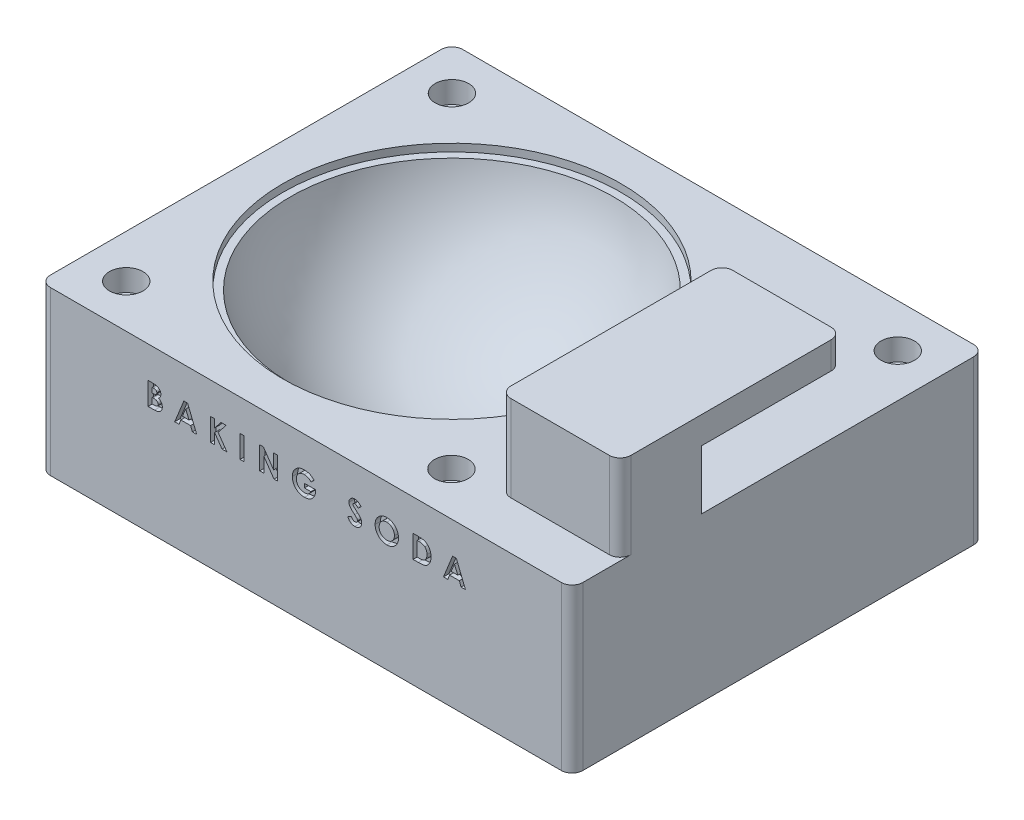
from build123d import *

# Parameters (mm, degrees)
SKETCH1_W           = 124.9426
SKETCH1_H           = 38.227
BOSS_EXTRUDE1_DEPTH = 96.7486
SKETCH3_W           = 3.175
SKETCH3_H           = 38.227
BOSS_EXTRUDE3_DEPTH = 13.843
SKETCH7_W           = 34.5313
SKETCH7_H           = 52.07
BOSS_EXTRUDE4_DEPTH = 6.35
SKETCH8_W           = 6.35
SKETCH8_H           = 20.193
CUT_EXTRUDE1_DEPTH  = 119.217289213
FILLET1_R           = 2.54
FILLET2_R           = 2.54
SKETCH9_R           = 2.54
CUT_EXTRUDE2_DEPTH  = 127.031942114
SKETCH10_W          = 0.949786325
SKETCH10_H          = 5.291666667
CUT_EXTRUDE3_DEPTH  = 1.27
SKETCH11_R          = 3.937
CUT_EXTRUDE4_DEPTH  = 5.08
SKETCH12_W          = 0.949786325
SKETCH12_H          = 5.291666667
CUT_EXTRUDE5_DEPTH  = 1.27


with BuildPart() as part:
    # Sketch1 → Boss-Extrude1 (new body)
    with BuildSketch(Plane.XY):
        with Locations((-8.679633195, 0.774989834)):
            Rectangle(SKETCH1_W, SKETCH1_H)
    extrude(amount=BOSS_EXTRUDE1_DEPTH)

    # Sketch2 → Cut-Revolve1 (revolve, cut)
    with BuildSketch(Plane.XY.offset(48.3743)):
        with BuildLine():
            Line((16.910866805, 19.888489834), (-22.776633195, 19.888489834))
            Line((-22.776633195, 19.888489834), (-22.776633195, -12.496510166))
            ThreePointArc((-22.776633195, -12.496510166), (1.584804772, -3.889675552), (15.132866805, 18.110489834))
            Line((15.132866805, 18.110489834), (16.910866805, 18.110489834))
            Line((16.910866805, 18.110489834), (16.910866805, 19.888489834))
        make_face()
    revolve(axis=Axis((-22.776633195, 19.888489834, 48.3743), (0, -1, 0)), mode=Mode.SUBTRACT)

    # Sketch3 → Cut-Revolve3 (revolve, cut)
    with BuildSketch(Plane.XY.offset(48.3743), mode=Mode.PRIVATE) as cut_revolve3_sk:
        with Locations((-21.189133195, 0.774989834)):
            Rectangle(SKETCH3_W, SKETCH3_H)
    revolve(cut_revolve3_sk.sketch.rotate(Axis((-22.776633195, -991.400961256, 48.3743), (0, 1, 0)), 90), axis=Axis((-22.776633195, -991.400961256, 48.3743), (0, 1, 0)), mode=Mode.SUBTRACT)

    # Sketch6 → Boss-Extrude3 (add)
    with BuildSketch(Plane(origin=(0, 19.888489834, 0), x_dir=(1, 0, 0), z_dir=(0, 1, 0))):
        Polygon((53.791666805, -85.477168571), (19.260366805, -85.477168571), (19.260366805, -58.5343), (53.791666805, -66.427168571), align=None)
    extrude(amount=BOSS_EXTRUDE3_DEPTH)

    # Sketch7 → Boss-Extrude4 (add)
    with BuildSketch(Plane(origin=(0, 33.731489834, 0), x_dir=(1, 0, 0), z_dir=(0, 1, 0))):
        with Locations((36.526016805, -59.442168571)):
            Rectangle(SKETCH7_W, SKETCH7_H)
    extrude(amount=BOSS_EXTRUDE4_DEPTH)

    # Sketch8 → Cut-Extrude1 (cut, through all)
    with BuildSketch(Plane.XY.offset(85.477168571)):
        with Locations((22.435366805, 29.984989834)):
            Rectangle(SKETCH8_W, SKETCH8_H)
    extrude(amount=-CUT_EXTRUDE1_DEPTH, mode=Mode.SUBTRACT)

    # Fillet1
    fillet1_edges = [part.edges().sort_by_distance(p)[0] for p in [
        (53.791666805, 0.774989834, 96.7486),
        (-71.150933195, 0.774989834, 96.7486),
        (53.791666805, 0.774989834, 0),
        (-71.150933195, 0.774989834, 0),
    ]]
    fillet(fillet1_edges, radius=FILLET1_R)

    # Fillet2
    fillet2_edges = [part.edges().sort_by_distance(p)[0] for p in [
        (53.791666805, 29.984989834, 85.477168571),
        (53.791666805, 36.906489834, 33.407168571),
        (25.610366805, 36.906489834, 33.407168571),
        (25.610366805, 29.984989834, 85.477168571),
    ]]
    fillet(fillet2_edges, radius=FILLET2_R)

    # Sketch9 → Cut-Extrude2 (cut, through all)
    with BuildSketch(Plane(origin=(0, 19.888489834, 0), x_dir=(1, 0, 0), z_dir=(0, 1, 0))):
        with Locations(Location((-60.990933195, -10.16, 0), (0, 0, 270))):
            Circle(SKETCH9_R)
        with Locations(Location((-60.990933195, -86.5886, 0), (0, 0, 270))):
            Circle(SKETCH9_R)
        with Locations(Location((15.323366805, -86.5886, 0), (0, 0, 270))):
            Circle(SKETCH9_R)
        with Locations(Location((43.631666805, -10.16, 0), (0, 0, 270))):
            Circle(SKETCH9_R)
    extrude(amount=-CUT_EXTRUDE2_DEPTH, mode=Mode.SUBTRACT)

    # Sketch10 → Cut-Extrude3 (cut)
    # profile 1 of 10: a face of its own
    with BuildSketch(Plane.XY.offset(96.7486)):
        with BuildLine():
            Line((-45.687378922, 7.188489834), (-45.687378922, 12.480156501))
            Line((-45.687378922, 12.480156501), (-44.839355417, 12.480156501))
            add(Edge.make_bspline(
                [(-44.839355417, 12.480156501), (-44.779988469, 12.480163276), (-44.665114551, 12.480176386), (-44.499381466, 12.474356384), (-44.345678027, 12.46682756), (-44.204493376, 12.458404556), (-44.075587209, 12.443890038), (-43.959155547, 12.428593321), (-43.854965761, 12.410146423), (-43.790550877, 12.393598985), (-43.760245508, 12.385813886)],
                knots=[0, 0, 0, 0, 1.311965854, 2.538629056, 3.664479157, 4.713267157, 5.663616078, 6.530575999, 7.308677837, 8, 8, 8, 8], degree=3))
            add(Edge.make_bspline(
                [(-43.760245508, 12.385813886), (-43.720451482, 12.374832865), (-43.642362827, 12.353284578), (-43.530514953, 12.309766879), (-43.424411643, 12.261393873), (-43.324182446, 12.206209319), (-43.230442809, 12.143546986), (-43.143548974, 12.072909568), (-43.061626857, 11.997132446), (-42.987585325, 11.914103734), (-42.92066398, 11.826368519), (-42.862521328, 11.733949792), (-42.812002817, 11.638260693), (-42.771574775, 11.53809704), (-42.741113005, 11.433920114), (-42.718833394, 11.326174765), (-42.704393189, 11.214520062), (-42.703028779, 11.138557717), (-42.702336186, 11.099998247)],
                knots=[0, 0, 0, 0, 1.099996261, 2.158545794, 3.195537121, 4.207578794, 5.205712374, 6.197378256, 7.190519799, 8.17788031, 9.159561366, 10.129234751, 11.085776129, 12.040971148, 13.00380137, 13.975669004, 14.972423361, 16, 16, 16, 16], degree=3))
            add(Edge.make_bspline(
                [(-42.702336186, 11.099998247), (-42.704147109, 11.05045945), (-42.707711688, 10.952948413), (-42.730482462, 10.809722342), (-42.773181211, 10.674353119), (-42.829051484, 10.544345939), (-42.90501759, 10.420185731), (-43.001479851, 10.301931529), (-43.116875896, 10.185942109), (-43.205391033, 10.116414276), (-43.251431405, 10.080249984)],
                knots=[0, 0, 0, 0, 0.986156485, 1.941127874, 2.875419072, 3.804401753, 4.751181392, 5.761612777, 6.835722519, 8, 8, 8, 8], degree=3))
            add(Edge.make_bspline(
                [(-43.251431405, 10.080249984), (-43.214122497, 10.061204109), (-43.140970049, 10.023860419), (-43.037115063, 9.96247854), (-42.940956683, 9.897191126), (-42.852063764, 9.829311788), (-42.772300936, 9.75596302), (-42.698374659, 9.681371281), (-42.63393207, 9.601262773), (-42.576305565, 9.518492717), (-42.526217543, 9.431862592), (-42.482596399, 9.341518697), (-42.445751184, 9.247152398), (-42.414549703, 9.149243942), (-42.39127963, 9.047456571), (-42.376107047, 8.941753881), (-42.36448997, 8.832496372), (-42.36358627, 8.758072885), (-42.363126785, 8.720232289)],
                knots=[0, 0, 0, 0, 1.164658916, 2.283573913, 3.35186032, 4.395461096, 5.390182219, 6.362969632, 7.312859996, 8.245001507, 9.165155236, 10.092416118, 11.032087915, 11.979892451, 12.947605196, 13.931445124, 14.948243989, 16, 16, 16, 16], degree=3))
            add(Edge.make_bspline(
                [(-42.363126785, 8.720232289), (-42.36610854, 8.647958914), (-42.371993021, 8.505327698), (-42.415017477, 8.295912316), (-42.489608214, 8.097367539), (-42.589768192, 7.910482471), (-42.713184556, 7.740667126), (-42.855077983, 7.591910359), (-43.014019931, 7.465991057), (-43.160663089, 7.381005297), (-43.287497872, 7.323971905), (-43.392552753, 7.288710266), (-43.505379469, 7.256043936), (-43.628044733, 7.233104965), (-43.758324792, 7.212108696), (-43.897489886, 7.199145165), (-44.045279915, 7.190360099), (-44.146788496, 7.18912586), (-44.199097672, 7.188489834)],
                knots=[0, 0, 0, 0, 1.284142165, 2.534249414, 3.780121997, 5.041676246, 6.291546858, 7.49970053, 8.684500223, 9.883330709, 10.50184324, 11.153274765, 11.851151195, 12.587658647, 13.369265475, 14.195992086, 15.070362669, 16, 16, 16, 16], degree=3))
            Line((-44.199097672, 7.188489834), (-45.687378922, 7.188489834))
        make_face()
        with BuildLine():
            Line((-44.737592597, 11.530370176), (-44.737592597, 10.37705821))
            Line((-44.737592597, 10.37705821), (-44.485305604, 10.37705821))
            add(Edge.make_bspline(
                [(-44.485305604, 10.37705821), (-44.451017535, 10.377357215), (-44.384826493, 10.377934426), (-44.289220554, 10.385368702), (-44.20032247, 10.39805204), (-44.118469413, 10.415748486), (-44.042898892, 10.438220392), (-43.974093673, 10.465258935), (-43.912356281, 10.498248896), (-43.840631709, 10.547388899), (-43.764813665, 10.619700614), (-43.698071894, 10.724169868), (-43.658761436, 10.844309113), (-43.654383311, 10.929040611), (-43.652122511, 10.972794722)],
                knots=[0, 0, 0, 0, 1.065314748, 2.056525647, 2.977365736, 3.853934255, 4.656397591, 5.425096493, 6.14721249, 6.826394842, 8.123232004, 9.372140726, 10.643011755, 12, 12, 12, 12], degree=3))
            add(Edge.make_bspline(
                [(-43.652122511, 10.972794722), (-43.653931565, 11.013777717), (-43.657429298, 11.09301669), (-43.697009875, 11.204275265), (-43.758486335, 11.302873134), (-43.831067938, 11.370355311), (-43.89941762, 11.416443649), (-43.957942813, 11.446790857), (-44.022178606, 11.473957367), (-44.093368537, 11.494729543), (-44.171106071, 11.510316252), (-44.255013594, 11.521762824), (-44.345235876, 11.529553847), (-44.407552598, 11.53009223), (-44.439724341, 11.530370176)],
                knots=[0, 0, 0, 0, 1.347982417, 2.606269829, 3.849316587, 5.153353503, 5.842674298, 6.568177932, 7.326619318, 8.142485038, 9.012069166, 9.942760135, 10.937925643, 12, 12, 12, 12], degree=3))
            Line((-44.439724341, 11.530370176), (-44.737592597, 11.530370176))
        make_face(mode=Mode.SUBTRACT)
        with BuildLine():
            Line((-44.737592597, 9.495113766), (-44.737592597, 8.138276159))
            Line((-44.737592597, 8.138276159), (-44.464105017, 8.138276159))
            add(Edge.make_bspline(
                [(-44.464105017, 8.138276159), (-44.410036174, 8.138585052), (-44.306082077, 8.139178938), (-44.157168016, 8.146354492), (-44.021767907, 8.159287163), (-43.900240508, 8.175432562), (-43.792399677, 8.197307052), (-43.698609942, 8.225117663), (-43.617585098, 8.255714178), (-43.549810973, 8.293504508), (-43.494443397, 8.33748308), (-43.444479963, 8.382430237), (-43.403742893, 8.434281029), (-43.371510963, 8.490809646), (-43.343614285, 8.550611875), (-43.326788979, 8.616022972), (-43.313978781, 8.68510431), (-43.313273801, 8.732886377), (-43.31291311, 8.757333317)],
                knots=[0, 0, 0, 0, 1.753078804, 3.370512758, 4.83203934, 6.162291463, 7.344201807, 8.395507345, 9.331626367, 10.147333109, 10.898971645, 11.62040215, 12.321813352, 13.025280112, 13.727906689, 14.453419512, 15.208716525, 16, 16, 16, 16], degree=3))
            add(Edge.make_bspline(
                [(-43.31291311, 8.757333317), (-43.313708538, 8.785288777), (-43.315257819, 8.839738493), (-43.327910814, 8.919322564), (-43.350905439, 8.993619575), (-43.379868291, 9.0645294), (-43.420171639, 9.129513222), (-43.46807079, 9.190819882), (-43.525945193, 9.246373349), (-43.591028335, 9.299533704), (-43.666941376, 9.346078475), (-43.753719934, 9.386464308), (-43.851835435, 9.420193068), (-43.961591804, 9.44704793), (-44.082507877, 9.469839279), (-44.215466208, 9.483448231), (-44.359359474, 9.493569806), (-44.459137406, 9.494587418), (-44.510746309, 9.495113766)],
                knots=[0, 0, 0, 0, 0.845221588, 1.646264278, 2.427170338, 3.19324141, 3.95557735, 4.731569926, 5.540061037, 6.376114724, 7.268642756, 8.224665384, 9.265483498, 10.400594375, 11.639216012, 12.983232105, 14.439614077, 16, 16, 16, 16], degree=3))
            Line((-44.510746309, 9.495113766), (-44.737592597, 9.495113766))
        make_face(mode=Mode.SUBTRACT)
    # profile 2 of 10: a face of its own
    with BuildSketch(Plane.XY.offset(96.7486)):
        Polygon((-37.30784667, 12.480156501), (-36.426962255, 12.480156501), (-34.289943024, 7.188489834), (-35.304391141, 7.188489834), (-35.715682541, 8.273959919), (-38.021246443, 8.273959919), (-38.432537842, 7.188489834), (-39.44592593, 7.188489834), align=None)
        Polygon((-36.867934477, 11.06077716), (-37.660836454, 9.223746244), (-36.075032501, 9.223746244), align=None, mode=Mode.SUBTRACT)
    # profile 3 of 10: a face of its own
    with BuildSketch(Plane.XY.offset(96.7486)):
        Polygon((-31.033532768, 12.480156501), (-30.083746443, 12.480156501), (-30.083746443, 10.617684879), (-28.58274484, 12.480156501), (-27.383851611, 12.480156501), (-29.269643879, 10.139611629), (-27.200466528, 7.188489834), (-28.34423823, 7.188489834), (-30.083746443, 9.670018613), (-30.083746443, 7.188489834), (-31.033532768, 7.188489834), align=None)
    # profile 4 of 10: a face of its own
    with BuildSketch(Plane.XY.offset(96.7486)):
        with Locations((-23.672688751, 9.834323168)):
            Rectangle(SKETCH10_W, SKETCH10_H)
    # profile 5 of 10: a face of its own
    with BuildSketch(Plane.XY.offset(96.7486)):
        Polygon((-19.50041311, 12.480156501), (-18.6449694, 12.480156501), (-16.244002853, 8.997959986), (-16.244002853, 12.480156501), (-15.294216528, 12.480156501), (-15.294216528, 7.188489834), (-16.156020415, 7.188489834), (-18.550626785, 10.660086055), (-18.550626785, 7.188489834), (-19.50041311, 7.188489834), align=None)
    # profile 6 of 10: a face of its own
    with BuildSketch(Plane.XY.offset(96.7486)):
        with BuildLine():
            Line((-6.747199635, 11.638493173), (-7.465899555, 10.950534105))
            add(Edge.make_bspline(
                [(-7.465899555, 10.950534105), (-7.522800281, 11.007503009), (-7.634448901, 11.119285403), (-7.817036252, 11.264777872), (-8.006141334, 11.388475233), (-8.202386568, 11.490187855), (-8.406045324, 11.569085009), (-8.616715697, 11.625522667), (-8.83474042, 11.658996798), (-8.982333425, 11.663683062), (-9.057003654, 11.666053937)],
                knots=[0, 0, 0, 0, 1.075575784, 2.110457258, 3.113929901, 4.09197124, 5.059417775, 6.02750972, 7.002078037, 8, 8, 8, 8], degree=3))
            add(Edge.make_bspline(
                [(-9.057003654, 11.666053937), (-9.12174046, 11.664392676), (-9.248856854, 11.661130645), (-9.435642151, 11.636359004), (-9.614126944, 11.594979091), (-9.785154469, 11.537654131), (-9.947680543, 11.463056241), (-10.102646874, 11.37233675), (-10.249099796, 11.264801648), (-10.385886098, 11.142489426), (-10.510430467, 11.008949174), (-10.619164277, 10.866013885), (-10.711782124, 10.716347749), (-10.7880255, 10.559185054), (-10.846038419, 10.394767013), (-10.887452051, 10.223212985), (-10.91373941, 10.045021529), (-10.916843162, 9.923457473), (-10.918415246, 9.861883931)],
                knots=[0, 0, 0, 0, 1.075001177, 2.110859044, 3.123021556, 4.114053297, 5.101481495, 6.087880186, 7.091499647, 8.114004866, 9.131394192, 10.11971144, 11.092043119, 12.050101265, 13.015322563, 13.981809771, 14.977764287, 16, 16, 16, 16], degree=3))
            add(Edge.make_bspline(
                [(-10.918415246, 9.861883931), (-10.916948881, 9.798179247), (-10.91405994, 9.672672297), (-10.886308401, 9.488485454), (-10.843552376, 9.311284438), (-10.780968956, 9.14238404), (-10.703947719, 8.97947056), (-10.606272101, 8.825699788), (-10.492372556, 8.678723475), (-10.362452607, 8.541100563), (-10.221133253, 8.414245359), (-10.068079795, 8.304816795), (-9.907949057, 8.210403565), (-9.738156521, 8.135631339), (-9.561649285, 8.075597433), (-9.376637056, 8.033268377), (-9.183536439, 8.007299648), (-9.051785629, 8.004177101), (-8.984921657, 8.002592398)],
                knots=[0, 0, 0, 0, 1.022067601, 2.013613092, 2.983553406, 3.943623673, 4.90013463, 5.87121881, 6.861774014, 7.881098904, 8.905697761, 9.905387765, 10.89678721, 11.884561068, 12.87834324, 13.885584958, 14.926927371, 16, 16, 16, 16], degree=3))
            add(Edge.make_bspline(
                [(-8.984921657, 8.002592398), (-8.941429119, 8.002984824), (-8.85604359, 8.003755243), (-8.73079757, 8.016261307), (-8.610841965, 8.034140181), (-8.495712222, 8.057809686), (-8.38657084, 8.091306283), (-8.281906684, 8.130476428), (-8.182332992, 8.17670501), (-8.088389643, 8.231587001), (-7.998678488, 8.293103004), (-7.91403924, 8.363490392), (-7.832987228, 8.44116219), (-7.756469533, 8.527067268), (-7.68578124, 8.62197372), (-7.618657676, 8.724137512), (-7.555867393, 8.834572558), (-7.518766271, 8.912556193), (-7.499820495, 8.952378723)],
                knots=[0, 0, 0, 0, 1.109579412, 2.178351274, 3.208885622, 4.204702371, 5.174744997, 6.119429583, 7.05542196, 7.97267548, 8.893247984, 9.828544973, 10.778894627, 11.756245826, 12.760884819, 13.796418446, 14.874735809, 16, 16, 16, 16], degree=3))
            Line((-7.499820495, 8.952378723), (-9.018842597, 8.952378723))
            Line((-9.018842597, 8.952378723), (-9.018842597, 9.902165048))
            Line((-9.018842597, 9.902165048), (-6.380429469, 9.902165048))
            Line((-6.380429469, 9.902165048), (-6.373009263, 9.67637879))
            add(Edge.make_bspline(
                [(-6.373009263, 9.67637879), (-6.373962705, 9.61839115), (-6.375867885, 9.502519354), (-6.393279241, 9.33000599), (-6.422120886, 9.159780657), (-6.461550175, 8.992014327), (-6.510965049, 8.825884045), (-6.573984482, 8.662980646), (-6.647779853, 8.502199375), (-6.73046233, 8.344223427), (-6.823373644, 8.19264121), (-6.923406317, 8.04911286), (-7.029134314, 7.913886794), (-7.142857176, 7.788847051), (-7.26280405, 7.67294324), (-7.389211052, 7.566621259), (-7.522525279, 7.469791144), (-7.662040512, 7.381634904), (-7.808551423, 7.30437116), (-7.961252497, 7.237161954), (-8.119913176, 7.180082594), (-8.284943084, 7.133289935), (-8.456017483, 7.097185677), (-8.633140039, 7.072428939), (-8.816408029, 7.055606458), (-8.94071483, 7.05375082), (-9.004002185, 7.052806073)],
                knots=[0, 0, 0, 0, 1.006889344, 2.011981806, 3.007738725, 4.003571281, 5.003404394, 6.015442001, 7.03424805, 8.074616296, 9.110249922, 10.119753985, 11.111721717, 12.089233633, 13.052717867, 14.006597561, 14.955430184, 15.912305663, 16.870361111, 17.829300583, 18.807640451, 19.796414044, 20.806216501, 21.841577364, 22.90109906, 24, 24, 24, 24], degree=3))
            add(Edge.make_bspline(
                [(-9.004002185, 7.052806073), (-9.071525503, 7.053739028), (-9.205376858, 7.055588423), (-9.403294025, 7.072909263), (-9.595469492, 7.101496192), (-9.781951192, 7.141059525), (-9.963172098, 7.190299252), (-10.138820844, 7.252106758), (-10.308538181, 7.325628741), (-10.472832334, 7.40891831), (-10.629603443, 7.503375937), (-10.778500159, 7.607345295), (-10.918709777, 7.721495172), (-11.051668477, 7.843914675), (-11.17426983, 7.977612886), (-11.291082709, 8.118255998), (-11.39644793, 8.271002239), (-11.494895886, 8.430899531), (-11.582357836, 8.597880869), (-11.658844568, 8.768857847), (-11.72407241, 8.942840507), (-11.775506141, 9.12063897), (-11.817265513, 9.301013478), (-11.847145127, 9.484748437), (-11.864019541, 9.671820847), (-11.866801373, 9.797543197), (-11.868201571, 9.860823902)],
                knots=[0, 0, 0, 0, 1.084149091, 2.14910686, 3.187506334, 4.202448172, 5.208724393, 6.201130722, 7.189831603, 8.176984443, 9.156919086, 10.126598231, 11.090766514, 12.05840148, 13.026036446, 14.001772938, 14.991905635, 16.003017641, 17.015720547, 18.016462227, 19.009322657, 19.99686681, 20.986544154, 21.980959929, 22.983742515, 24, 24, 24, 24], degree=3))
            add(Edge.make_bspline(
                [(-11.868201571, 9.860823902), (-11.866326406, 9.947152306), (-11.862623512, 10.117625311), (-11.828329089, 10.368733127), (-11.774869194, 10.611654885), (-11.698148861, 10.845505878), (-11.599698558, 11.07060824), (-11.480912922, 11.287490408), (-11.33921167, 11.495921857), (-11.229525169, 11.624969872), (-11.173882327, 11.690434612)],
                knots=[0, 0, 0, 0, 1.034044851, 2.041932006, 3.031217818, 4.011390712, 4.986069675, 5.97149666, 6.970960976, 8, 8, 8, 8], degree=3))
            add(Edge.make_bspline(
                [(-11.173882327, 11.690434612), (-11.13933423, 11.728307949), (-11.070756778, 11.803485951), (-10.961135845, 11.907947316), (-10.848734894, 12.006144863), (-10.731997155, 12.095996376), (-10.611536296, 12.179468747), (-10.48700561, 12.25499722), (-10.359058355, 12.324986661), (-10.226696698, 12.385863145), (-10.09061357, 12.440443991), (-9.950206282, 12.486627061), (-9.806526454, 12.527534284), (-9.658301797, 12.558654189), (-9.507029733, 12.584568471), (-9.351636484, 12.601937579), (-9.192545504, 12.6146679), (-9.084944366, 12.615446383), (-9.03050292, 12.615840261)],
                knots=[0, 0, 0, 0, 1.020590567, 2.025856924, 3.013483481, 3.991664875, 4.957826714, 5.930500614, 6.890802512, 7.860442893, 8.829981142, 9.809047939, 10.802672283, 11.803273349, 12.823572789, 13.857849586, 14.916166035, 16, 16, 16, 16], degree=3))
            add(Edge.make_bspline(
                [(-9.03050292, 12.615840261), (-8.973593933, 12.614962627), (-8.860365945, 12.613216457), (-8.692014679, 12.601134098), (-8.526002766, 12.582493865), (-8.363029797, 12.554532453), (-8.202548834, 12.520050211), (-8.045390566, 12.475869925), (-7.890529728, 12.425673162), (-7.789715909, 12.385652594), (-7.739387135, 12.365673328)],
                knots=[0, 0, 0, 0, 1.03180557, 2.052914215, 3.058998889, 4.059601663, 5.049854447, 6.033765722, 7.018406786, 8, 8, 8, 8], degree=3))
            add(Edge.make_bspline(
                [(-7.739387135, 12.365673328), (-7.697041697, 12.347208889), (-7.610912248, 12.309652733), (-7.485604516, 12.240941983), (-7.359990622, 12.164768231), (-7.235426006, 12.078346387), (-7.112100467, 11.981838101), (-6.988726357, 11.876767704), (-6.866563122, 11.761910015), (-6.787502744, 11.680164899), (-6.747199635, 11.638493173)],
                knots=[0, 0, 0, 0, 0.894392155, 1.819168899, 2.76525314, 3.739198753, 4.75366411, 5.797420238, 6.877176959, 8, 8, 8, 8], degree=3))
        make_face()
    # profile 7 of 10: a face of its own
    with BuildSketch(Plane.XY.offset(96.7486)):
        with BuildLine():
            Line((4.27816595, 11.773116904), (3.567946265, 11.123318894))
            add(Edge.make_bspline(
                [(3.567946265, 11.123318894), (3.5375235, 11.166233368), (3.479116031, 11.248623174), (3.384443618, 11.358945066), (3.290198699, 11.453057849), (3.195508152, 11.530568365), (3.099532678, 11.591005679), (3.002438874, 11.633795965), (2.904777193, 11.660998156), (2.839163619, 11.664385484), (2.80684517, 11.666053937)],
                knots=[0, 0, 0, 0, 1.299362458, 2.494594718, 3.587462134, 4.587049575, 5.512617175, 6.380583204, 7.202344345, 8, 8, 8, 8], degree=3))
            add(Edge.make_bspline(
                [(2.80684517, 11.666053937), (2.776699449, 11.664996728), (2.71849598, 11.662955537), (2.635522618, 11.642666245), (2.561857685, 11.607649907), (2.497573075, 11.5618631), (2.44665018, 11.506700612), (2.405992198, 11.448849346), (2.383098337, 11.384994632), (2.380085054, 11.341136638), (2.378593301, 11.319424329)],
                knots=[0, 0, 0, 0, 1.185010067, 2.2879431, 3.333075148, 4.379039566, 5.372662701, 6.27520591, 7.14612461, 8, 8, 8, 8], degree=3))
            add(Edge.make_bspline(
                [(2.378593301, 11.319424329), (2.379528107, 11.297398919), (2.381410677, 11.253042805), (2.399593742, 11.188033395), (2.427000812, 11.124511634), (2.453189386, 11.085842916), (2.466575739, 11.066077307)],
                knots=[0, 0, 0, 0, 0.967525499, 1.948461899, 2.951351359, 4, 4, 4, 4], degree=3))
            add(Edge.make_bspline(
                [(2.466575739, 11.066077307), (2.478745382, 11.050713707), (2.506758293, 11.015348727), (2.560173176, 10.959336111), (2.627251052, 10.890715754), (2.710573217, 10.811847309), (2.80668074, 10.719894358), (2.920028329, 10.618471606), (3.047353345, 10.504438109), (3.137853017, 10.425029311), (3.185275659, 10.383418386)],
                knots=[0, 0, 0, 0, 0.473873513, 1.090794244, 1.870441696, 2.795289791, 3.865433203, 5.087734844, 6.473946851, 8, 8, 8, 8], degree=3))
            add(Edge.make_bspline(
                [(3.185275659, 10.383418386), (3.229788631, 10.344894655), (3.314265003, 10.271784616), (3.434458105, 10.168016654), (3.540087824, 10.074659149), (3.632692943, 9.993113197), (3.71086966, 9.922523194), (3.774946629, 9.862551722), (3.825706442, 9.814366314), (3.854560424, 9.785262298), (3.866874551, 9.772841463)],
                knots=[0, 0, 0, 0, 1.543621617, 2.929473131, 4.163658386, 5.240097082, 6.164993805, 6.925417477, 7.541396219, 8, 8, 8, 8], degree=3))
            add(Edge.make_bspline(
                [(3.866874551, 9.772841463), (3.91359178, 9.722283416), (4.0033987, 9.625093095), (4.120116037, 9.474478662), (4.216178181, 9.327448265), (4.290493678, 9.181235287), (4.34661973, 9.033730168), (4.38618934, 8.881315351), (4.409887842, 8.722398198), (4.412518929, 8.613956641), (4.413849711, 8.559107823)],
                knots=[0, 0, 0, 0, 1.206664779, 2.319633467, 3.337109185, 4.282041471, 5.190008762, 6.099243693, 7.03861361, 8, 8, 8, 8], degree=3))
            add(Edge.make_bspline(
                [(4.413849711, 8.559107823), (4.412902495, 8.505664376), (4.411044021, 8.400806345), (4.388281286, 8.247362235), (4.355822961, 8.100509562), (4.305636696, 7.961846291), (4.244469974, 7.829096307), (4.167788654, 7.704327432), (4.077736958, 7.586276954), (3.974523887, 7.47705517), (3.860357975, 7.377943971), (3.737904184, 7.289712841), (3.6059651, 7.216866804), (3.465667988, 7.156883289), (3.317087948, 7.110683184), (3.160401983, 7.076537001), (2.99537043, 7.056042999), (2.882519476, 7.053900595), (2.82486567, 7.052806073)],
                knots=[0, 0, 0, 0, 1.043214005, 2.046824704, 3.02475056, 3.976699089, 4.921714032, 5.875962561, 6.831408892, 7.817874052, 8.806269674, 9.781291748, 10.760897367, 11.74438705, 12.757449933, 13.795994037, 14.874007457, 16, 16, 16, 16], degree=3))
            add(Edge.make_bspline(
                [(2.82486567, 7.052806073), (2.779607923, 7.053608976), (2.689971629, 7.055199183), (2.557861283, 7.068181905), (2.430293809, 7.089134635), (2.307412902, 7.119166158), (2.18866496, 7.157220169), (2.074045108, 7.203701687), (1.964344603, 7.259331157), (1.858733401, 7.322964615), (1.757724901, 7.396851443), (1.660041891, 7.479481047), (1.566654651, 7.572124308), (1.477114662, 7.674562129), (1.391994825, 7.787084588), (1.308508862, 7.908124603), (1.230367142, 8.039928511), (1.182095525, 8.132390019), (1.157439455, 8.179617305)],
                knots=[0, 0, 0, 0, 1.016823716, 2.013894106, 2.979844003, 3.91962641, 4.853723003, 5.779685073, 6.695824784, 7.614987388, 8.547259901, 9.504950863, 10.487499108, 11.500346958, 12.559593716, 13.656357062, 14.802919212, 16, 16, 16, 16], degree=3))
            Line((1.157439455, 8.179617305), (1.992742606, 8.681011202))
            add(Edge.make_bspline(
                [(1.992742606, 8.681011202), (2.023583665, 8.627402062), (2.082708611, 8.524628759), (2.182901359, 8.386539801), (2.285543715, 8.268289466), (2.393008677, 8.171967837), (2.503989512, 8.096286969), (2.619022283, 8.042200171), (2.73818781, 8.008720504), (2.819357953, 8.004631863), (2.859846639, 8.002592398)],
                knots=[0, 0, 0, 0, 1.283663364, 2.460892379, 3.537111102, 4.529833553, 5.449777664, 6.316464042, 7.160231139, 8, 8, 8, 8], degree=3))
            add(Edge.make_bspline(
                [(2.859846639, 8.002592398), (2.90102943, 8.004257936), (2.980930041, 8.007489322), (3.094977939, 8.037336661), (3.19954137, 8.084199173), (3.289925228, 8.151065516), (3.36645658, 8.228239438), (3.422941111, 8.314098955), (3.458425074, 8.40699688), (3.462176589, 8.471529889), (3.464063386, 8.503986295)],
                knots=[0, 0, 0, 0, 1.13588714, 2.203786484, 3.234766741, 4.283437687, 5.291419208, 6.222934724, 7.106237994, 8, 8, 8, 8], degree=3))
            add(Edge.make_bspline(
                [(3.464063386, 8.503986295), (3.462321006, 8.534181699), (3.458781528, 8.595520772), (3.432710823, 8.686722109), (3.39195436, 8.77788197), (3.343736589, 8.852653754), (3.29466897, 8.915258143), (3.247749258, 8.969502013), (3.190613462, 9.029431993), (3.123406451, 9.095123471), (3.047016207, 9.167154745), (2.961378379, 9.245518761), (2.865512324, 9.329525227), (2.797754008, 9.386749601), (2.762323936, 9.416671592)],
                knots=[0, 0, 0, 0, 0.916159276, 1.861089862, 2.860218735, 3.940849679, 4.552606315, 5.27541173, 6.11797699, 7.06649574, 8.129236253, 9.306560635, 10.591630461, 12, 12, 12, 12], degree=3))
            add(Edge.make_bspline(
                [(2.762323936, 9.416671592), (2.694969961, 9.473659514), (2.565697294, 9.583036586), (2.383018616, 9.744583078), (2.21840877, 9.895563077), (2.073289503, 10.037843026), (1.945811773, 10.168795344), (1.836838913, 10.289483676), (1.747568039, 10.400838967), (1.653629694, 10.532731858), (1.564369485, 10.693452408), (1.487223334, 10.886817861), (1.437174167, 11.080158779), (1.431566854, 11.209957222), (1.428806976, 11.273843066)],
                knots=[0, 0, 0, 0, 1.345494975, 2.582412109, 3.71882943, 4.751509156, 5.681369928, 6.505683931, 7.230279997, 7.856715994, 8.973648664, 10.023341002, 11.027102913, 12, 12, 12, 12], degree=3))
            add(Edge.make_bspline(
                [(1.428806976, 11.273843066), (1.429954806, 11.319147477), (1.432216154, 11.408402034), (1.452387726, 11.539637855), (1.482534909, 11.666269395), (1.526317274, 11.787834645), (1.583141498, 11.904181339), (1.65215231, 12.015879044), (1.734421317, 12.121899719), (1.827132935, 12.22217308), (1.929277401, 12.313811521), (2.038431744, 12.394691627), (2.15397814, 12.463004141), (2.275209735, 12.519674332), (2.402877751, 12.563051763), (2.536041664, 12.593799848), (2.674892472, 12.612087828), (2.769335794, 12.614573867), (2.817445464, 12.615840261)],
                knots=[0, 0, 0, 0, 1.010766082, 1.991317756, 2.957454644, 3.913069143, 4.869106762, 5.843196583, 6.838735724, 7.860187025, 8.887984031, 9.89767229, 10.887916223, 11.879572884, 12.879850636, 13.892031539, 14.926195476, 16, 16, 16, 16], degree=3))
            add(Edge.make_bspline(
                [(2.817445464, 12.615840261), (2.879793215, 12.613559448), (3.003996566, 12.609015825), (3.187634803, 12.573486176), (3.367004954, 12.517612061), (3.511544784, 12.450206088), (3.626552429, 12.384909891), (3.714695045, 12.324793377), (3.804384901, 12.25592668), (3.896345291, 12.178092782), (3.988867448, 12.08982519), (4.084582219, 11.993225184), (4.182185373, 11.887457914), (4.245611948, 11.811898266), (4.27816595, 11.773116904)],
                knots=[0, 0, 0, 0, 1.282922637, 2.555718331, 3.837320111, 5.142675274, 5.830281639, 6.55870424, 7.337177975, 8.157850921, 9.037902056, 9.96903443, 10.957596896, 12, 12, 12, 12], degree=3))
        make_face()
    # profile 8 of 10: a face of its own
    with BuildSketch(Plane.XY.offset(96.7486)):
        with BuildLine():
            add(Edge.make_bspline(
                [(10.326693595, 12.615840261), (10.418695705, 12.613458162), (10.600328709, 12.608755358), (10.867445312, 12.569553819), (11.12486155, 12.50568053), (11.372461018, 12.416892039), (11.609623757, 12.300783502), (11.837186318, 12.160646673), (12.054333583, 11.993836552), (12.258840402, 11.804244544), (12.447841586, 11.598071514), (12.611611222, 11.376089593), (12.751267959, 11.144050554), (12.867015837, 10.901332644), (12.95517939, 10.646254924), (13.017047402, 10.380117953), (13.056794535, 10.102997446), (13.061366067, 9.914316153), (13.063689455, 9.818422727)],
                knots=[0, 0, 0, 0, 1.014329547, 2.002516266, 2.970391464, 3.935626869, 4.897733899, 5.877609409, 6.878433252, 7.912639331, 8.949961323, 9.958554974, 10.949718813, 11.932905612, 12.9188844, 13.919928257, 14.942845884, 16, 16, 16, 16], degree=3))
            add(Edge.make_bspline(
                [(13.063689455, 9.818422727), (13.061215147, 9.723609798), (13.056339444, 9.53677788), (13.018670054, 9.262211147), (12.955760177, 8.998925059), (12.869091947, 8.746323659), (12.755443298, 8.505630464), (12.618510019, 8.27530868), (12.454678701, 8.05749575), (12.269924915, 7.852308558), (12.06652703, 7.666057154), (11.851096381, 7.501923425), (11.624627693, 7.362842698), (11.387452445, 7.248878677), (11.139062025, 7.160435397), (10.880069988, 7.098032237), (10.610492361, 7.060108577), (10.427166501, 7.055264722), (10.3341138, 7.052806073)],
                knots=[0, 0, 0, 0, 1.051557043, 2.072126891, 3.067553643, 4.050577992, 5.02905126, 6.015227836, 7.017913613, 8.04756643, 9.074058332, 10.072836633, 11.047628519, 12.017157415, 12.98668631, 13.966869689, 14.968021931, 16, 16, 16, 16], degree=3))
            add(Edge.make_bspline(
                [(10.3341138, 7.052806073), (10.236791833, 7.055011602), (10.045567469, 7.059345164), (9.765709757, 7.100555363), (9.497581887, 7.162632318), (9.243436287, 7.255278843), (9.000684703, 7.37109479), (8.771110701, 7.513729073), (8.554791432, 7.682945976), (8.352967741, 7.874411793), (8.170114988, 8.083917392), (8.008711567, 8.305241478), (7.8725642, 8.53669333), (7.761667908, 8.778381273), (7.674241725, 9.028803275), (7.612572487, 9.289484477), (7.576142996, 9.559799673), (7.57106858, 9.743403158), (7.568497147, 9.836443226)],
                knots=[0, 0, 0, 0, 1.067978421, 2.098431617, 3.099715153, 4.085208694, 5.062210972, 6.048429807, 7.046490867, 8.072918869, 9.098532598, 10.095778865, 11.076610158, 12.041847152, 13.011192615, 13.984257998, 14.978533688, 16, 16, 16, 16], degree=3))
            add(Edge.make_bspline(
                [(7.568497147, 9.836443226), (7.569304211, 9.899035714), (7.570908119, 10.023428124), (7.590228885, 10.207771327), (7.618045232, 10.388516398), (7.659184291, 10.564942704), (7.709157732, 10.73829485), (7.773905384, 10.906959232), (7.847605734, 11.07273765), (7.933717654, 11.233672052), (8.029465784, 11.388281707), (8.133935517, 11.535837296), (8.247389543, 11.674554654), (8.369462388, 11.805345376), (8.500574731, 11.927349764), (8.639001926, 12.042294961), (8.787428654, 12.147127613), (8.942606319, 12.244407943), (9.103660066, 12.332376858), (9.26993426, 12.407253368), (9.438003323, 12.472641749), (9.610112432, 12.52424915), (9.784417132, 12.566282838), (9.962779514, 12.594080438), (10.143588178, 12.613400668), (10.265513607, 12.615025134), (10.326693595, 12.615840261)],
                knots=[0, 0, 0, 0, 1.034744296, 2.056386356, 3.06226378, 4.057406941, 5.050368692, 6.043467995, 7.042652155, 8.049140477, 9.059438543, 10.048523776, 11.036952808, 12.020949711, 13.004946614, 13.997082645, 14.994316842, 16.007702937, 17.024872941, 18.026463647, 19.021641123, 20.005082605, 20.995858141, 21.984425357, 22.988620895, 24, 24, 24, 24], degree=3))
        make_face()
        with BuildLine():
            add(Edge.make_bspline(
                [(10.311853183, 11.666053937), (10.249935775, 11.664392554), (10.127735589, 11.661113648), (9.94849017, 11.636132824), (9.776408238, 11.596235608), (9.612443711, 11.538444979), (9.455885952, 11.464892176), (9.306457433, 11.3758342), (9.16622743, 11.268209784), (9.033326112, 11.147796803), (8.91327164, 11.013629069), (8.807199726, 10.869845524), (8.71843462, 10.716686285), (8.644093287, 10.555574165), (8.588130739, 10.384697501), (8.548270295, 10.205394787), (8.523079982, 10.017357077), (8.519904711, 9.889172014), (8.518283472, 9.823722874)],
                knots=[0, 0, 0, 0, 1.033739768, 2.040188636, 3.016340934, 3.979330865, 4.937572243, 5.900995986, 6.878200029, 7.884839167, 8.891893314, 9.879764717, 10.863503415, 11.843163062, 12.837761627, 13.859916423, 14.907309254, 16, 16, 16, 16], degree=3))
            add(Edge.make_bspline(
                [(8.518283472, 9.823722874), (8.520432988, 9.751190503), (8.524645684, 9.609039075), (8.554286724, 9.401672401), (8.604999593, 9.205835159), (8.67822799, 9.022485159), (8.769050413, 8.849586437), (8.881837449, 8.689258112), (9.014762481, 8.540540213), (9.117166849, 8.453712509), (9.169141511, 8.40964368)],
                knots=[0, 0, 0, 0, 1.078454662, 2.113592447, 3.107694534, 4.079536787, 5.043276885, 6.005368276, 6.987637804, 8, 8, 8, 8], degree=3))
            add(Edge.make_bspline(
                [(9.169141511, 8.40964368), (9.211718682, 8.377087322), (9.295913754, 8.312708105), (9.430307418, 8.230192932), (9.568706429, 8.159469197), (9.712155181, 8.102325256), (9.860350717, 8.057376793), (10.013272715, 8.025900123), (10.170704498, 8.00614579), (10.277167247, 8.003784773), (10.330933712, 8.002592398)],
                knots=[0, 0, 0, 0, 1.023928204, 2.024787132, 3.009472467, 3.9914905, 4.972207045, 5.96565515, 6.972602802, 8, 8, 8, 8], degree=3))
            add(Edge.make_bspline(
                [(10.330933712, 8.002592398), (10.391786449, 8.004267868), (10.511516122, 8.007564407), (10.687424791, 8.032237704), (10.855950638, 8.07399383), (11.018139886, 8.131277499), (11.173524855, 8.205753822), (11.321346135, 8.297574097), (11.461862898, 8.405610889), (11.594594902, 8.527605156), (11.715918228, 8.662301418), (11.821768791, 8.806851889), (11.913356184, 8.958071689), (11.986151588, 9.118101106), (12.044325089, 9.285429537), (12.083705793, 9.460798043), (12.109108907, 9.643483689), (12.112285072, 9.767807727), (12.11390313, 9.831143079)],
                knots=[0, 0, 0, 0, 1.026359118, 2.019393844, 2.989460624, 3.950973911, 4.916101784, 5.890408035, 6.881132271, 7.902007068, 8.92769091, 9.933912415, 10.920395702, 11.90457117, 12.894218921, 13.903490204, 14.931958862, 16, 16, 16, 16], degree=3))
            add(Edge.make_bspline(
                [(12.11390313, 9.831143079), (12.112229087, 9.894114236), (12.108933988, 10.018063354), (12.084217265, 10.200279316), (12.042725946, 10.374873622), (11.985270259, 10.542131402), (11.911902391, 10.70221663), (11.821175578, 10.854566353), (11.71340817, 10.999033286), (11.591080428, 11.134632942), (11.457934199, 11.25924034), (11.314988419, 11.36737691), (11.16624287, 11.461344151), (11.008284605, 11.534954293), (10.844345316, 11.593599337), (10.673424638, 11.636786389), (10.494875198, 11.660938157), (10.373404323, 11.664333476), (10.311853183, 11.666053937)],
                knots=[0, 0, 0, 0, 1.055025985, 2.07665775, 3.074803781, 4.057872707, 5.035505728, 6.020516407, 7.023567878, 8.050795229, 9.077271434, 10.074415901, 11.050397877, 12.019801805, 12.988065821, 13.964604439, 14.968634123, 16, 16, 16, 16], degree=3))
        make_face(mode=Mode.SUBTRACT)
    # profile 9 of 10: a face of its own
    with BuildSketch(Plane.XY.offset(96.7486)):
        with BuildLine():
            Line((16.489704412, 12.480156501), (17.686477582, 12.480156501))
            add(Edge.make_bspline(
                [(17.686477582, 12.480156501), (17.779779816, 12.479504286), (17.960134089, 12.478243548), (18.221431751, 12.464038062), (18.464405325, 12.442191032), (18.689211439, 12.412136484), (18.895389201, 12.372366086), (19.082672752, 12.322481916), (19.251690658, 12.264898942), (19.404296167, 12.197140887), (19.543610319, 12.118141725), (19.675893552, 12.030143), (19.800886132, 11.929921063), (19.920342131, 11.819409395), (20.032719945, 11.696586217), (20.139891067, 11.563485928), (20.239231462, 11.418178389), (20.333743974, 11.264147617), (20.419217965, 11.100740843), (20.493771574, 10.929348954), (20.556225585, 10.751074918), (20.606972702, 10.565728743), (20.647424012, 10.373925722), (20.675726977, 10.175278813), (20.693224153, 9.969971931), (20.694999095, 9.830825376), (20.695900993, 9.760121111)],
                knots=[0, 0, 0, 0, 1.44355588, 2.790409838, 4.047694926, 5.217575253, 6.298404546, 7.294384826, 8.214239204, 9.058592145, 9.873746385, 10.689560431, 11.514393297, 12.350027578, 13.205127629, 14.088021785, 14.991911688, 15.926770944, 16.882954281, 17.842803888, 18.816321264, 19.80318086, 20.814351908, 21.847355356, 22.906180909, 24, 24, 24, 24], degree=3))
            add(Edge.make_bspline(
                [(20.695900993, 9.760121111), (20.693539338, 9.66035279), (20.68889028, 9.463953011), (20.64972922, 9.175738598), (20.586392526, 8.899456337), (20.497335381, 8.637267415), (20.386928362, 8.391506663), (20.255034814, 8.166507969), (20.103588605, 7.963479012), (19.93435409, 7.78343071), (19.751114328, 7.628676754), (19.560691265, 7.496141315), (19.361229832, 7.391626063), (19.185476435, 7.325347764), (19.033076313, 7.284128396), (18.899270655, 7.259767352), (18.74728108, 7.237426806), (18.575690417, 7.220162513), (18.385251397, 7.204767006), (18.175204929, 7.196401686), (17.946231082, 7.189451348), (17.787187095, 7.188818737), (17.704498082, 7.188489834)],
                knots=[0, 0, 0, 0, 1.315458931, 2.589557908, 3.828601765, 5.048913369, 6.235739168, 7.376350998, 8.481830359, 9.569842114, 10.627874879, 11.640079404, 12.624025415, 13.590060155, 14.111227486, 14.704434459, 15.382649715, 16.137166398, 16.978595427, 17.902333227, 18.909396075, 20, 20, 20, 20], degree=3))
            Line((17.704498082, 7.188489834), (16.489704412, 7.188489834))
            Line((16.489704412, 7.188489834), (16.489704412, 12.480156501))
        make_face()
        with BuildLine():
            Line((17.439490737, 11.530370176), (17.439490737, 8.138276159))
            Line((17.439490737, 8.138276159), (17.935584487, 8.138276159))
            add(Edge.make_bspline(
                [(17.935584487, 8.138276159), (17.994612024, 8.138384322), (18.108141629, 8.138592355), (18.27205268, 8.148501158), (18.423628841, 8.158446863), (18.562452858, 8.177324145), (18.689535051, 8.198352108), (18.803129641, 8.227615398), (18.905578307, 8.258354005), (18.995629659, 8.297488063), (19.078109361, 8.341536048), (19.154476143, 8.39314337), (19.228191469, 8.450451355), (19.297877171, 8.515145511), (19.363796992, 8.586369168), (19.425560911, 8.664489308), (19.48399331, 8.749267585), (19.537594342, 8.841152243), (19.586575252, 8.93917296), (19.630026807, 9.04238026), (19.666054559, 9.15163364), (19.69599862, 9.265910355), (19.717397047, 9.386205315), (19.735100164, 9.511627511), (19.744226637, 9.642673856), (19.745479188, 9.731842169), (19.746114668, 9.777081581)],
                knots=[0, 0, 0, 0, 1.50275155, 2.890291501, 4.180787663, 5.369391935, 6.45668281, 7.458360028, 8.354766181, 9.177074746, 9.954075863, 10.732690366, 11.5210699, 12.329727389, 13.151100085, 13.990027547, 14.863562427, 15.770965086, 16.696477834, 17.652329173, 18.619756807, 19.62365428, 20.657822005, 21.729286259, 22.847956731, 24, 24, 24, 24], degree=3))
            add(Edge.make_bspline(
                [(19.746114668, 9.777081581), (19.744849008, 9.846406703), (19.742381067, 9.98158532), (19.718580785, 10.178475926), (19.679838465, 10.363877927), (19.624556908, 10.537103247), (19.554872791, 10.698638739), (19.467646876, 10.847115856), (19.366633028, 10.985028809), (19.286754034, 11.065932973), (19.24684083, 11.106358424)],
                knots=[0, 0, 0, 0, 1.13821349, 2.219428113, 3.251817212, 4.244760574, 5.201143372, 6.134805572, 7.068016741, 8, 8, 8, 8], degree=3))
            add(Edge.make_bspline(
                [(19.24684083, 11.106358424), (19.207482632, 11.140806373), (19.127097968, 11.211162409), (18.985968915, 11.295466932), (18.830452008, 11.369536719), (18.656989485, 11.428265799), (18.467257787, 11.47471126), (18.260126865, 11.506743558), (18.036705953, 11.527327174), (17.88192515, 11.529334111), (17.802020785, 11.530370176)],
                knots=[0, 0, 0, 0, 0.813307809, 1.661089106, 2.549956539, 3.493439533, 4.508053171, 5.589449661, 6.755572447, 8, 8, 8, 8], degree=3))
            Line((17.802020785, 11.530370176), (17.439490737, 11.530370176))
        make_face(mode=Mode.SUBTRACT)
    # profile 10 of 10: a face of its own
    with BuildSketch(Plane.XY.offset(96.7486)):
        Polygon((25.751181108, 12.480156501), (26.632065523, 12.480156501), (28.769084754, 7.188489834), (27.754636637, 7.188489834), (27.343345237, 8.273959919), (25.037781335, 8.273959919), (24.626489935, 7.188489834), (23.613101848, 7.188489834), align=None)
        Polygon((26.191093301, 11.06077716), (25.398191324, 9.223746244), (26.983995277, 9.223746244), align=None, mode=Mode.SUBTRACT)
    extrude(amount=-CUT_EXTRUDE3_DEPTH, mode=Mode.SUBTRACT)

    # Sketch11 → Cut-Extrude4 (cut)
    with BuildSketch(Plane(origin=(0, 19.888489834, 0), x_dir=(1, 0, 0), z_dir=(0, 1, 0))):
        with Locations(Location((-60.990933195, -10.16, 0), (0, 0, 270))):
            Circle(SKETCH11_R)
        with Locations(Location((43.631666805, -10.16, 0), (0, 0, 270))):
            Circle(SKETCH11_R)
        with Locations(Location((-60.990933195, -86.5886, 0), (0, 0, 270))):
            Circle(SKETCH11_R)
        with Locations(Location((15.323366805, -86.5886, 0), (0, 0, 270))):
            Circle(SKETCH11_R)
    extrude(amount=-CUT_EXTRUDE4_DEPTH, mode=Mode.SUBTRACT)

    # Sketch12 → Cut-Extrude5 (cut)
    # profile 1 of 10: a face of its own
    with BuildSketch(Plane(origin=(0, 0, 0), x_dir=(-1, 0, 0), z_dir=(0, 0, -1))):
        with BuildLine():
            Line((-28.328112531, 0.774989834), (-28.328112531, 6.066656501))
            Line((-28.328112531, 6.066656501), (-27.480089027, 6.066656501))
            add(Edge.make_bspline(
                [(-27.480089027, 6.066656501), (-27.420722079, 6.066663276), (-27.305848161, 6.066676386), (-27.140115076, 6.060856384), (-26.986411637, 6.05332756), (-26.845226986, 6.044904556), (-26.716320819, 6.030390038), (-26.599889157, 6.015093321), (-26.49569937, 5.996646423), (-26.431284487, 5.980098985), (-26.400979118, 5.972313886)],
                knots=[0, 0, 0, 0, 1.311965854, 2.538629056, 3.664479157, 4.713267157, 5.663616078, 6.530575999, 7.308677837, 8, 8, 8, 8], degree=3))
            add(Edge.make_bspline(
                [(-26.400979118, 5.972313886), (-26.361185092, 5.961332865), (-26.283096437, 5.939784578), (-26.171248563, 5.896266879), (-26.065145253, 5.847893873), (-25.964916056, 5.792709319), (-25.871176419, 5.730046986), (-25.784282584, 5.659409568), (-25.702360467, 5.583632446), (-25.628318935, 5.500603734), (-25.561397589, 5.412868519), (-25.503254938, 5.320449792), (-25.452736427, 5.224760693), (-25.412308385, 5.12459704), (-25.381846615, 5.020420114), (-25.359567004, 4.912674765), (-25.345126799, 4.801020062), (-25.343762389, 4.725057717), (-25.343069796, 4.686498247)],
                knots=[0, 0, 0, 0, 1.099996261, 2.158545794, 3.195537121, 4.207578794, 5.205712374, 6.197378256, 7.190519799, 8.17788031, 9.159561366, 10.129234751, 11.085776129, 12.040971148, 13.00380137, 13.975669004, 14.972423361, 16, 16, 16, 16], degree=3))
            add(Edge.make_bspline(
                [(-25.343069796, 4.686498247), (-25.344880719, 4.63695945), (-25.348445298, 4.539448413), (-25.371216072, 4.396222342), (-25.413914821, 4.260853119), (-25.469785094, 4.130845939), (-25.5457512, 4.006685731), (-25.642213461, 3.888431529), (-25.757609506, 3.772442109), (-25.846124643, 3.702914276), (-25.892165015, 3.666749984)],
                knots=[0, 0, 0, 0, 0.986156485, 1.941127874, 2.875419072, 3.804401753, 4.751181392, 5.761612777, 6.835722519, 8, 8, 8, 8], degree=3))
            add(Edge.make_bspline(
                [(-25.892165015, 3.666749984), (-25.854856107, 3.647704109), (-25.781703659, 3.610360419), (-25.677848673, 3.54897854), (-25.581690293, 3.483691126), (-25.492797374, 3.415811788), (-25.413034546, 3.34246302), (-25.339108268, 3.267871281), (-25.27466568, 3.187762773), (-25.217039175, 3.104992717), (-25.166951153, 3.018362592), (-25.123330009, 2.928018697), (-25.086484794, 2.833652398), (-25.055283313, 2.735743942), (-25.03201324, 2.633956571), (-25.016840657, 2.528253881), (-25.00522358, 2.418996372), (-25.00431988, 2.344572885), (-25.003860395, 2.306732289)],
                knots=[0, 0, 0, 0, 1.164658916, 2.283573913, 3.35186032, 4.395461096, 5.390182219, 6.362969632, 7.312859996, 8.245001507, 9.165155236, 10.092416118, 11.032087915, 11.979892451, 12.947605196, 13.931445124, 14.948243989, 16, 16, 16, 16], degree=3))
            add(Edge.make_bspline(
                [(-25.003860395, 2.306732289), (-25.00684215, 2.234458914), (-25.012726631, 2.091827698), (-25.055751087, 1.882412316), (-25.130341824, 1.683867539), (-25.230501802, 1.496982471), (-25.353918166, 1.327167126), (-25.495811593, 1.178410359), (-25.654753541, 1.052491057), (-25.801396699, 0.967505297), (-25.928231482, 0.910471905), (-26.033286363, 0.875210266), (-26.146113079, 0.842543936), (-26.268778343, 0.819604965), (-26.399058402, 0.798608696), (-26.538223495, 0.785645165), (-26.686013525, 0.776860099), (-26.787522106, 0.77562586), (-26.839831281, 0.774989834)],
                knots=[0, 0, 0, 0, 1.284142165, 2.534249414, 3.780121997, 5.041676246, 6.291546858, 7.49970053, 8.684500223, 9.883330709, 10.50184324, 11.153274765, 11.851151195, 12.587658647, 13.369265475, 14.195992086, 15.070362669, 16, 16, 16, 16], degree=3))
            Line((-26.839831281, 0.774989834), (-28.328112531, 0.774989834))
        make_face()
        with BuildLine():
            Line((-27.378326207, 5.116870176), (-27.378326207, 3.96355821))
            Line((-27.378326207, 3.96355821), (-27.126039214, 3.96355821))
            add(Edge.make_bspline(
                [(-27.126039214, 3.96355821), (-27.091751145, 3.963857215), (-27.025560103, 3.964434426), (-26.929954164, 3.971868702), (-26.84105608, 3.98455204), (-26.759203023, 4.002248486), (-26.683632502, 4.024720392), (-26.614827283, 4.051758935), (-26.553089891, 4.084748896), (-26.481365319, 4.133888899), (-26.405547275, 4.206200614), (-26.338805504, 4.310669868), (-26.299495046, 4.430809113), (-26.295116921, 4.515540611), (-26.292856121, 4.559294722)],
                knots=[0, 0, 0, 0, 1.065314748, 2.056525647, 2.977365736, 3.853934255, 4.656397591, 5.425096493, 6.14721249, 6.826394842, 8.123232004, 9.372140726, 10.643011755, 12, 12, 12, 12], degree=3))
            add(Edge.make_bspline(
                [(-26.292856121, 4.559294722), (-26.294665175, 4.600277717), (-26.298162908, 4.67951669), (-26.337743484, 4.790775265), (-26.399219945, 4.889373134), (-26.471801548, 4.956855311), (-26.54015123, 5.002943649), (-26.598676423, 5.033290857), (-26.662912216, 5.060457367), (-26.734102147, 5.081229543), (-26.811839681, 5.096816252), (-26.895747204, 5.108262824), (-26.985969486, 5.116053847), (-27.048286208, 5.11659223), (-27.080457951, 5.116870176)],
                knots=[0, 0, 0, 0, 1.347982417, 2.606269829, 3.849316587, 5.153353503, 5.842674298, 6.568177932, 7.326619318, 8.142485038, 9.012069166, 9.942760135, 10.937925643, 12, 12, 12, 12], degree=3))
            Line((-27.080457951, 5.116870176), (-27.378326207, 5.116870176))
        make_face(mode=Mode.SUBTRACT)
        with BuildLine():
            Line((-27.378326207, 3.081613766), (-27.378326207, 1.724776159))
            Line((-27.378326207, 1.724776159), (-27.104838627, 1.724776159))
            add(Edge.make_bspline(
                [(-27.104838627, 1.724776159), (-27.050769784, 1.725085052), (-26.946815687, 1.725678938), (-26.797901626, 1.732854492), (-26.662501517, 1.745787163), (-26.540974118, 1.761932562), (-26.433133287, 1.783807052), (-26.339343552, 1.811617663), (-26.258318708, 1.842214178), (-26.190544583, 1.880004508), (-26.135177006, 1.92398308), (-26.085213573, 1.968930237), (-26.044476503, 2.020781029), (-26.012244573, 2.077309646), (-25.984347895, 2.137111875), (-25.967522588, 2.202522972), (-25.954712391, 2.27160431), (-25.954007411, 2.319386377), (-25.95364672, 2.343833317)],
                knots=[0, 0, 0, 0, 1.753078804, 3.370512758, 4.83203934, 6.162291463, 7.344201807, 8.395507345, 9.331626367, 10.147333109, 10.898971645, 11.62040215, 12.321813352, 13.025280112, 13.727906689, 14.453419512, 15.208716525, 16, 16, 16, 16], degree=3))
            add(Edge.make_bspline(
                [(-25.95364672, 2.343833317), (-25.954442148, 2.371788777), (-25.955991429, 2.426238493), (-25.968644424, 2.505822564), (-25.991639049, 2.580119575), (-26.020601901, 2.6510294), (-26.060905249, 2.716013222), (-26.1088044, 2.777319882), (-26.166678802, 2.832873349), (-26.231761945, 2.886033704), (-26.307674986, 2.932578475), (-26.394453544, 2.972964308), (-26.492569045, 3.006693068), (-26.602325414, 3.03354793), (-26.723241487, 3.056339279), (-26.856199818, 3.069948231), (-27.000093084, 3.080069806), (-27.099871016, 3.081087418), (-27.151479919, 3.081613766)],
                knots=[0, 0, 0, 0, 0.845221588, 1.646264278, 2.427170338, 3.19324141, 3.95557735, 4.731569926, 5.540061037, 6.376114724, 7.268642756, 8.224665384, 9.265483498, 10.400594375, 11.639216012, 12.983232105, 14.439614077, 16, 16, 16, 16], degree=3))
            Line((-27.151479919, 3.081613766), (-27.378326207, 3.081613766))
        make_face(mode=Mode.SUBTRACT)
    # profile 2 of 10: a face of its own
    with BuildSketch(Plane(origin=(0, 0, 0), x_dir=(-1, 0, 0), z_dir=(0, 0, -1))):
        Polygon((-19.94858028, 6.066656501), (-19.067695865, 6.066656501), (-16.930676634, 0.774989834), (-17.945124751, 0.774989834), (-18.356416151, 1.860459919), (-20.661980053, 1.860459919), (-21.073271452, 0.774989834), (-22.08665954, 0.774989834), align=None)
        Polygon((-19.508668087, 4.64727716), (-20.301570064, 2.810246244), (-18.715766111, 2.810246244), align=None, mode=Mode.SUBTRACT)
    # profile 3 of 10: a face of its own
    with BuildSketch(Plane(origin=(0, 0, 0), x_dir=(-1, 0, 0), z_dir=(0, 0, -1))):
        Polygon((-13.674266378, 6.066656501), (-12.724480053, 6.066656501), (-12.724480053, 4.204184879), (-11.22347845, 6.066656501), (-10.024585221, 6.066656501), (-11.910377489, 3.726111629), (-9.841200138, 0.774989834), (-10.98497184, 0.774989834), (-12.724480053, 3.256518613), (-12.724480053, 0.774989834), (-13.674266378, 0.774989834), align=None)
    # profile 4 of 10: a face of its own
    with BuildSketch(Plane(origin=(0, 0, 0), x_dir=(-1, 0, 0), z_dir=(0, 0, -1))):
        with Locations((-6.313422361, 3.420823168)):
            Rectangle(SKETCH12_W, SKETCH12_H)
    # profile 5 of 10: a face of its own
    with BuildSketch(Plane(origin=(0, 0, 0), x_dir=(-1, 0, 0), z_dir=(0, 0, -1))):
        Polygon((-2.14114672, 6.066656501), (-1.28570301, 6.066656501), (1.115263537, 2.584459986), (1.115263537, 6.066656501), (2.065049862, 6.066656501), (2.065049862, 0.774989834), (1.203245975, 0.774989834), (-1.191360395, 4.246586055), (-1.191360395, 0.774989834), (-2.14114672, 0.774989834), align=None)
    # profile 6 of 10: a face of its own
    with BuildSketch(Plane(origin=(0, 0, 0), x_dir=(-1, 0, 0), z_dir=(0, 0, -1))):
        with BuildLine():
            Line((10.612066755, 5.224993173), (9.893366836, 4.537034105))
            add(Edge.make_bspline(
                [(9.893366836, 4.537034105), (9.836466109, 4.594003009), (9.724817489, 4.705785403), (9.542230138, 4.851277872), (9.353125056, 4.974975233), (9.156879822, 5.076687855), (8.953221066, 5.155585009), (8.742550693, 5.212022667), (8.52452597, 5.245496798), (8.376932965, 5.250183062), (8.302262736, 5.252553937)],
                knots=[0, 0, 0, 0, 1.075575784, 2.110457258, 3.113929901, 4.09197124, 5.059417775, 6.02750972, 7.002078037, 8, 8, 8, 8], degree=3))
            add(Edge.make_bspline(
                [(8.302262736, 5.252553937), (8.23752593, 5.250892676), (8.110409536, 5.247630645), (7.923624239, 5.222859004), (7.745139446, 5.181479091), (7.574111921, 5.124154131), (7.411585847, 5.049556241), (7.256619516, 4.95883675), (7.110166594, 4.851301648), (6.973380292, 4.728989426), (6.848835923, 4.595449174), (6.740102113, 4.452513885), (6.647484266, 4.302847749), (6.57124089, 4.145685054), (6.513227971, 3.981267013), (6.471814339, 3.809712985), (6.44552698, 3.631521529), (6.442423228, 3.509957473), (6.440851144, 3.448383931)],
                knots=[0, 0, 0, 0, 1.075001177, 2.110859044, 3.123021556, 4.114053297, 5.101481495, 6.087880186, 7.091499647, 8.114004866, 9.131394192, 10.11971144, 11.092043119, 12.050101265, 13.015322563, 13.981809771, 14.977764287, 16, 16, 16, 16], degree=3))
            add(Edge.make_bspline(
                [(6.440851144, 3.448383931), (6.442317509, 3.384679247), (6.44520645, 3.259172297), (6.472957989, 3.074985454), (6.515714014, 2.897784438), (6.578297434, 2.72888404), (6.655318671, 2.56597056), (6.752994289, 2.412199788), (6.866893834, 2.265223475), (6.996813783, 2.127600563), (7.138133137, 2.000745359), (7.291186595, 1.891316795), (7.451317333, 1.796903565), (7.621109869, 1.722131339), (7.797617105, 1.662097433), (7.982629334, 1.619768377), (8.175729951, 1.593799648), (8.307480761, 1.590677101), (8.374344733, 1.589092398)],
                knots=[0, 0, 0, 0, 1.022067601, 2.013613092, 2.983553406, 3.943623673, 4.90013463, 5.87121881, 6.861774014, 7.881098904, 8.905697761, 9.905387765, 10.89678721, 11.884561068, 12.87834324, 13.885584958, 14.926927371, 16, 16, 16, 16], degree=3))
            add(Edge.make_bspline(
                [(8.374344733, 1.589092398), (8.417837271, 1.589484824), (8.5032228, 1.590255243), (8.62846882, 1.602761307), (8.748424425, 1.620640181), (8.863554169, 1.644309686), (8.97269555, 1.677806283), (9.077359706, 1.716976428), (9.176933398, 1.76320501), (9.270876747, 1.818087001), (9.360587902, 1.879603004), (9.44522715, 1.949990392), (9.526279162, 2.02766219), (9.602796857, 2.113567268), (9.67348515, 2.20847372), (9.740608714, 2.310637512), (9.803398997, 2.421072558), (9.840500119, 2.499056193), (9.859445895, 2.538878723)],
                knots=[0, 0, 0, 0, 1.109579412, 2.178351274, 3.208885622, 4.204702371, 5.174744997, 6.119429583, 7.05542196, 7.97267548, 8.893247984, 9.828544973, 10.778894627, 11.756245826, 12.760884819, 13.796418446, 14.874735809, 16, 16, 16, 16], degree=3))
            Line((9.859445895, 2.538878723), (8.340423793, 2.538878723))
            Line((8.340423793, 2.538878723), (8.340423793, 3.488665048))
            Line((8.340423793, 3.488665048), (10.978836921, 3.488665048))
            Line((10.978836921, 3.488665048), (10.986257127, 3.26287879))
            add(Edge.make_bspline(
                [(10.986257127, 3.26287879), (10.985303685, 3.20489115), (10.983398505, 3.089019354), (10.965987149, 2.91650599), (10.937145504, 2.746280657), (10.897716215, 2.578514327), (10.848301341, 2.412384045), (10.785281908, 2.249480646), (10.711486538, 2.088699375), (10.62880406, 1.930723427), (10.535892746, 1.77914121), (10.435860073, 1.63561286), (10.330132076, 1.500386794), (10.216409214, 1.375347051), (10.09646234, 1.25944324), (9.970055338, 1.153121259), (9.836741111, 1.056291144), (9.697225878, 0.968134904), (9.550714967, 0.89087116), (9.398013893, 0.823661954), (9.239353214, 0.766582594), (9.074323306, 0.719789935), (8.903248907, 0.683685677), (8.726126351, 0.658928939), (8.542858361, 0.642106458), (8.41855156, 0.64025082), (8.355264205, 0.639306073)],
                knots=[0, 0, 0, 0, 1.006889344, 2.011981806, 3.007738725, 4.003571281, 5.003404394, 6.015442001, 7.03424805, 8.074616296, 9.110249922, 10.119753985, 11.111721717, 12.089233633, 13.052717867, 14.006597561, 14.955430184, 15.912305663, 16.870361111, 17.829300583, 18.807640451, 19.796414044, 20.806216501, 21.841577364, 22.90109906, 24, 24, 24, 24], degree=3))
            add(Edge.make_bspline(
                [(8.355264205, 0.639306073), (8.287740887, 0.640239028), (8.153889532, 0.642088423), (7.955972365, 0.659409263), (7.763796898, 0.687996192), (7.577315198, 0.727559525), (7.396094292, 0.776799252), (7.220445546, 0.838606758), (7.050728209, 0.912128741), (6.886434057, 0.99541831), (6.729662947, 1.089875937), (6.580766231, 1.193845295), (6.440556613, 1.307995172), (6.307597913, 1.430414675), (6.18499656, 1.564112886), (6.068183681, 1.704755998), (5.96281846, 1.857502239), (5.864370504, 2.017399531), (5.776908554, 2.184380869), (5.700421822, 2.355357847), (5.63519398, 2.529340507), (5.583760249, 2.70713897), (5.542000877, 2.887513478), (5.512121263, 3.071248437), (5.495246849, 3.258320847), (5.492465017, 3.384043197), (5.491064819, 3.447323902)],
                knots=[0, 0, 0, 0, 1.084149091, 2.14910686, 3.187506334, 4.202448172, 5.208724393, 6.201130722, 7.189831603, 8.176984443, 9.156919086, 10.126598231, 11.090766514, 12.05840148, 13.026036446, 14.001772938, 14.991905635, 16.003017641, 17.015720547, 18.016462227, 19.009322657, 19.99686681, 20.986544154, 21.980959929, 22.983742515, 24, 24, 24, 24], degree=3))
            add(Edge.make_bspline(
                [(5.491064819, 3.447323902), (5.492939984, 3.533652306), (5.496642878, 3.704125311), (5.530937301, 3.955233127), (5.584397196, 4.198154885), (5.661117529, 4.432005878), (5.759567832, 4.65710824), (5.878353468, 4.873990408), (6.02005472, 5.082421857), (6.129741221, 5.211469872), (6.185384063, 5.276934612)],
                knots=[0, 0, 0, 0, 1.034044851, 2.041932006, 3.031217818, 4.011390712, 4.986069675, 5.97149666, 6.970960976, 8, 8, 8, 8], degree=3))
            add(Edge.make_bspline(
                [(6.185384063, 5.276934612), (6.21993216, 5.314807949), (6.288509612, 5.389985951), (6.398130545, 5.494447316), (6.510531496, 5.592644863), (6.627269235, 5.682496376), (6.747730094, 5.765968747), (6.87226078, 5.84149722), (7.000208035, 5.911486661), (7.132569692, 5.972363145), (7.26865282, 6.026943991), (7.409060108, 6.073127061), (7.552739936, 6.114034284), (7.700964593, 6.145154189), (7.852236657, 6.171068471), (8.007629906, 6.188437579), (8.166720886, 6.2011679), (8.274322024, 6.201946383), (8.32876347, 6.202340261)],
                knots=[0, 0, 0, 0, 1.020590567, 2.025856924, 3.013483481, 3.991664875, 4.957826714, 5.930500614, 6.890802512, 7.860442893, 8.829981142, 9.809047939, 10.802672283, 11.803273349, 12.823572789, 13.857849586, 14.916166035, 16, 16, 16, 16], degree=3))
            add(Edge.make_bspline(
                [(8.32876347, 6.202340261), (8.385672457, 6.201462627), (8.498900445, 6.199716457), (8.667251711, 6.187634098), (8.833263624, 6.168993865), (8.996236593, 6.141032453), (9.156717556, 6.106550211), (9.313875824, 6.062369925), (9.468736662, 6.012173162), (9.569550481, 5.972152594), (9.619879255, 5.952173328)],
                knots=[0, 0, 0, 0, 1.03180557, 2.052914215, 3.058998889, 4.059601663, 5.049854447, 6.033765722, 7.018406786, 8, 8, 8, 8], degree=3))
            add(Edge.make_bspline(
                [(9.619879255, 5.952173328), (9.662224693, 5.933708889), (9.748354142, 5.896152733), (9.873661874, 5.827441983), (9.999275768, 5.751268231), (10.123840384, 5.664846387), (10.247165923, 5.568338101), (10.370540033, 5.463267704), (10.492703268, 5.348410015), (10.571763646, 5.266664899), (10.612066755, 5.224993173)],
                knots=[0, 0, 0, 0, 0.894392155, 1.819168899, 2.76525314, 3.739198753, 4.75366411, 5.797420238, 6.877176959, 8, 8, 8, 8], degree=3))
        make_face()
    # profile 7 of 10: a face of its own
    with BuildSketch(Plane(origin=(0, 0, 0), x_dir=(-1, 0, 0), z_dir=(0, 0, -1))):
        with BuildLine():
            Line((21.63743234, 5.359616904), (20.927212655, 4.709818894))
            add(Edge.make_bspline(
                [(20.927212655, 4.709818894), (20.89678989, 4.752733368), (20.838382422, 4.835123174), (20.743710008, 4.945445066), (20.649465089, 5.039557849), (20.554774542, 5.117068365), (20.458799068, 5.177505679), (20.361705264, 5.220295965), (20.264043583, 5.247498156), (20.198430009, 5.250885484), (20.16611156, 5.252553937)],
                knots=[0, 0, 0, 0, 1.299362458, 2.494594718, 3.587462134, 4.587049575, 5.512617175, 6.380583204, 7.202344345, 8, 8, 8, 8], degree=3))
            add(Edge.make_bspline(
                [(20.16611156, 5.252553937), (20.135965839, 5.251496728), (20.07776237, 5.249455537), (19.994789008, 5.229166245), (19.921124075, 5.194149907), (19.856839466, 5.1483631), (19.80591657, 5.093200612), (19.765258588, 5.035349346), (19.742364727, 4.971494632), (19.739351444, 4.927636638), (19.737859691, 4.905924329)],
                knots=[0, 0, 0, 0, 1.185010067, 2.2879431, 3.333075148, 4.379039566, 5.372662701, 6.27520591, 7.14612461, 8, 8, 8, 8], degree=3))
            add(Edge.make_bspline(
                [(19.737859691, 4.905924329), (19.738794497, 4.883898919), (19.740677067, 4.839542805), (19.758860132, 4.774533395), (19.786267202, 4.711011634), (19.812455776, 4.672342916), (19.825842129, 4.652577307)],
                knots=[0, 0, 0, 0, 0.967525499, 1.948461899, 2.951351359, 4, 4, 4, 4], degree=3))
            add(Edge.make_bspline(
                [(19.825842129, 4.652577307), (19.838011772, 4.637213707), (19.866024683, 4.601848727), (19.919439566, 4.545836111), (19.986517442, 4.477215754), (20.069839607, 4.398347309), (20.16594713, 4.306394358), (20.279294719, 4.204971606), (20.406619735, 4.090938109), (20.497119407, 4.011529311), (20.544542049, 3.969918386)],
                knots=[0, 0, 0, 0, 0.473873513, 1.090794244, 1.870441696, 2.795289791, 3.865433203, 5.087734844, 6.473946851, 8, 8, 8, 8], degree=3))
            add(Edge.make_bspline(
                [(20.544542049, 3.969918386), (20.589055021, 3.931394655), (20.673531393, 3.858284616), (20.793724495, 3.754516654), (20.899354214, 3.661159149), (20.991959333, 3.579613197), (21.07013605, 3.509023194), (21.134213019, 3.449051722), (21.184972832, 3.400866314), (21.213826814, 3.371762298), (21.226140941, 3.359341463)],
                knots=[0, 0, 0, 0, 1.543621617, 2.929473131, 4.163658386, 5.240097082, 6.164993805, 6.925417477, 7.541396219, 8, 8, 8, 8], degree=3))
            add(Edge.make_bspline(
                [(21.226140941, 3.359341463), (21.27285817, 3.308783416), (21.36266509, 3.211593095), (21.479382427, 3.060978662), (21.575444572, 2.913948265), (21.649760068, 2.767735287), (21.70588612, 2.620230168), (21.74545573, 2.467815351), (21.769154232, 2.308898198), (21.77178532, 2.200456641), (21.773116101, 2.145607823)],
                knots=[0, 0, 0, 0, 1.206664779, 2.319633467, 3.337109185, 4.282041471, 5.190008762, 6.099243693, 7.03861361, 8, 8, 8, 8], degree=3))
            add(Edge.make_bspline(
                [(21.773116101, 2.145607823), (21.772168885, 2.092164376), (21.770310411, 1.987306345), (21.747547676, 1.833862235), (21.715089351, 1.687009562), (21.664903086, 1.548346291), (21.603736364, 1.415596307), (21.527055044, 1.290827432), (21.437003348, 1.172776954), (21.333790277, 1.06355517), (21.219624365, 0.964443971), (21.097170574, 0.876212841), (20.96523149, 0.803366804), (20.824934378, 0.743383289), (20.676354338, 0.697183184), (20.519668373, 0.663037001), (20.35463682, 0.642542999), (20.241785866, 0.640400595), (20.18413206, 0.639306073)],
                knots=[0, 0, 0, 0, 1.043214005, 2.046824704, 3.02475056, 3.976699089, 4.921714032, 5.875962561, 6.831408892, 7.817874052, 8.806269674, 9.781291748, 10.760897367, 11.74438705, 12.757449933, 13.795994037, 14.874007457, 16, 16, 16, 16], degree=3))
            add(Edge.make_bspline(
                [(20.18413206, 0.639306073), (20.138874313, 0.640108976), (20.049238019, 0.641699183), (19.917127673, 0.654681905), (19.789560199, 0.675634635), (19.666679292, 0.705666158), (19.54793135, 0.743720169), (19.433311498, 0.790201687), (19.323610993, 0.845831157), (19.217999791, 0.909464615), (19.116991291, 0.983351443), (19.019308281, 1.065981047), (18.925921041, 1.158624308), (18.836381052, 1.261062129), (18.751261215, 1.373584588), (18.667775252, 1.494624603), (18.589633532, 1.626428511), (18.541361915, 1.718890019), (18.516705845, 1.766117305)],
                knots=[0, 0, 0, 0, 1.016823716, 2.013894106, 2.979844003, 3.91962641, 4.853723003, 5.779685073, 6.695824784, 7.614987388, 8.547259901, 9.504950863, 10.487499108, 11.500346958, 12.559593716, 13.656357062, 14.802919212, 16, 16, 16, 16], degree=3))
            Line((18.516705845, 1.766117305), (19.352008996, 2.267511202))
            add(Edge.make_bspline(
                [(19.352008996, 2.267511202), (19.382850055, 2.213902062), (19.441975001, 2.111128759), (19.542167749, 1.973039801), (19.644810105, 1.854789466), (19.752275067, 1.758467837), (19.863255902, 1.682786969), (19.978288673, 1.628700171), (20.0974542, 1.595220504), (20.178624343, 1.591131863), (20.219113029, 1.589092398)],
                knots=[0, 0, 0, 0, 1.283663364, 2.460892379, 3.537111102, 4.529833553, 5.449777664, 6.316464042, 7.160231139, 8, 8, 8, 8], degree=3))
            add(Edge.make_bspline(
                [(20.219113029, 1.589092398), (20.26029582, 1.590757936), (20.340196431, 1.593989322), (20.454244329, 1.623836661), (20.55880776, 1.670699173), (20.649191618, 1.737565516), (20.72572297, 1.814739438), (20.782207501, 1.900598955), (20.817691464, 1.99349688), (20.821442979, 2.058029889), (20.823329776, 2.090486295)],
                knots=[0, 0, 0, 0, 1.13588714, 2.203786484, 3.234766741, 4.283437687, 5.291419208, 6.222934724, 7.106237994, 8, 8, 8, 8], degree=3))
            add(Edge.make_bspline(
                [(20.823329776, 2.090486295), (20.821587396, 2.120681699), (20.818047918, 2.182020772), (20.791977213, 2.273222109), (20.75122075, 2.36438197), (20.703002979, 2.439153754), (20.65393536, 2.501758143), (20.607015648, 2.556002013), (20.549879852, 2.615931993), (20.482672841, 2.681623471), (20.406282597, 2.753654745), (20.320644769, 2.832018761), (20.224778714, 2.916025227), (20.157020398, 2.973249601), (20.121590326, 3.003171592)],
                knots=[0, 0, 0, 0, 0.916159276, 1.861089862, 2.860218735, 3.940849679, 4.552606315, 5.27541173, 6.11797699, 7.06649574, 8.129236253, 9.306560635, 10.591630461, 12, 12, 12, 12], degree=3))
            add(Edge.make_bspline(
                [(20.121590326, 3.003171592), (20.054236351, 3.060159514), (19.924963684, 3.169536586), (19.742285006, 3.331083078), (19.57767516, 3.482063077), (19.432555893, 3.624343026), (19.305078163, 3.755295344), (19.196105303, 3.875983676), (19.106834429, 3.987338967), (19.012896084, 4.119231858), (18.923635875, 4.279952408), (18.846489724, 4.473317861), (18.796440557, 4.666658779), (18.790833244, 4.796457222), (18.788073366, 4.860343066)],
                knots=[0, 0, 0, 0, 1.345494975, 2.582412109, 3.71882943, 4.751509156, 5.681369928, 6.505683931, 7.230279997, 7.856715994, 8.973648664, 10.023341002, 11.027102913, 12, 12, 12, 12], degree=3))
            add(Edge.make_bspline(
                [(18.788073366, 4.860343066), (18.789221196, 4.905647477), (18.791482544, 4.994902034), (18.811654116, 5.126137855), (18.841801299, 5.252769395), (18.885583664, 5.374334645), (18.942407888, 5.490681339), (19.0114187, 5.602379044), (19.093687708, 5.708399719), (19.186399325, 5.80867308), (19.288543791, 5.900311521), (19.397698134, 5.981191627), (19.51324453, 6.049504141), (19.634476125, 6.106174332), (19.762144141, 6.149551763), (19.895308054, 6.180299848), (20.034158862, 6.198587828), (20.128602184, 6.201073867), (20.176711854, 6.202340261)],
                knots=[0, 0, 0, 0, 1.010766082, 1.991317756, 2.957454644, 3.913069143, 4.869106762, 5.843196583, 6.838735724, 7.860187025, 8.887984031, 9.89767229, 10.887916223, 11.879572884, 12.879850636, 13.892031539, 14.926195476, 16, 16, 16, 16], degree=3))
            add(Edge.make_bspline(
                [(20.176711854, 6.202340261), (20.239059605, 6.200059448), (20.363262956, 6.195515825), (20.546901193, 6.159986176), (20.726271344, 6.104112061), (20.870811174, 6.036706088), (20.985818819, 5.971409891), (21.073961435, 5.911293377), (21.163651291, 5.84242668), (21.255611681, 5.764592782), (21.348133838, 5.67632519), (21.443848609, 5.579725184), (21.541451763, 5.473957914), (21.604878338, 5.398398266), (21.63743234, 5.359616904)],
                knots=[0, 0, 0, 0, 1.282922637, 2.555718331, 3.837320111, 5.142675274, 5.830281639, 6.55870424, 7.337177975, 8.157850921, 9.037902056, 9.96903443, 10.957596896, 12, 12, 12, 12], degree=3))
        make_face()
    # profile 8 of 10: a face of its own
    with BuildSketch(Plane(origin=(0, 0, 0), x_dir=(-1, 0, 0), z_dir=(0, 0, -1))):
        with BuildLine():
            add(Edge.make_bspline(
                [(27.685959985, 6.202340261), (27.777962095, 6.199958162), (27.959595099, 6.195255358), (28.226711703, 6.156053819), (28.48412794, 6.09218053), (28.731727408, 6.003392039), (28.968890147, 5.887283502), (29.196452708, 5.747146673), (29.413599973, 5.580336552), (29.618106792, 5.390744544), (29.807107976, 5.184571514), (29.970877612, 4.962589593), (30.110534349, 4.730550554), (30.226282227, 4.487832644), (30.31444578, 4.232754924), (30.376313792, 3.966617953), (30.416060925, 3.689497446), (30.420632457, 3.500816153), (30.422955845, 3.404922727)],
                knots=[0, 0, 0, 0, 1.014329547, 2.002516266, 2.970391464, 3.935626869, 4.897733899, 5.877609409, 6.878433252, 7.912639331, 8.949961323, 9.958554974, 10.949718813, 11.932905612, 12.9188844, 13.919928257, 14.942845884, 16, 16, 16, 16], degree=3))
            add(Edge.make_bspline(
                [(30.422955845, 3.404922727), (30.420481537, 3.310109798), (30.415605834, 3.12327788), (30.377936444, 2.848711147), (30.315026567, 2.585425059), (30.228358337, 2.332823659), (30.114709688, 2.092130464), (29.977776409, 1.86180868), (29.813945091, 1.64399575), (29.629191305, 1.438808558), (29.42579342, 1.252557154), (29.210362771, 1.088423425), (28.983894083, 0.949342698), (28.746718835, 0.835378677), (28.498328415, 0.746935397), (28.239336378, 0.684532237), (27.969758751, 0.646608577), (27.786432891, 0.641764722), (27.69338019, 0.639306073)],
                knots=[0, 0, 0, 0, 1.051557043, 2.072126891, 3.067553643, 4.050577992, 5.02905126, 6.015227836, 7.017913613, 8.04756643, 9.074058332, 10.072836633, 11.047628519, 12.017157415, 12.98668631, 13.966869689, 14.968021931, 16, 16, 16, 16], degree=3))
            add(Edge.make_bspline(
                [(27.69338019, 0.639306073), (27.596058223, 0.641511602), (27.404833859, 0.645845164), (27.124976147, 0.687055363), (26.856848277, 0.749132318), (26.602702677, 0.841778843), (26.359951093, 0.95759479), (26.130377091, 1.100229073), (25.914057823, 1.269445976), (25.712234131, 1.460911793), (25.529381378, 1.670417392), (25.367977957, 1.891741478), (25.23183059, 2.12319333), (25.120934298, 2.364881273), (25.033508115, 2.615303275), (24.971838877, 2.875984477), (24.935409386, 3.146299673), (24.93033497, 3.329903158), (24.927763537, 3.422943226)],
                knots=[0, 0, 0, 0, 1.067978421, 2.098431617, 3.099715153, 4.085208694, 5.062210972, 6.048429807, 7.046490867, 8.072918869, 9.098532598, 10.095778865, 11.076610158, 12.041847152, 13.011192615, 13.984257998, 14.978533688, 16, 16, 16, 16], degree=3))
            add(Edge.make_bspline(
                [(24.927763537, 3.422943226), (24.928570601, 3.485535714), (24.930174509, 3.609928124), (24.949495275, 3.794271327), (24.977311622, 3.975016398), (25.018450681, 4.151442704), (25.068424122, 4.32479485), (25.133171774, 4.493459232), (25.206872124, 4.65923765), (25.292984045, 4.820172052), (25.388732174, 4.974781707), (25.493201907, 5.122337296), (25.606655933, 5.261054654), (25.728728778, 5.391845376), (25.859841121, 5.513849764), (25.998268316, 5.628794961), (26.146695044, 5.733627613), (26.30187271, 5.830907943), (26.462926456, 5.918876858), (26.62920065, 5.993753368), (26.797269713, 6.059141749), (26.969378822, 6.11074915), (27.143683522, 6.152782838), (27.322045904, 6.180580438), (27.502854568, 6.199900668), (27.624779997, 6.201525134), (27.685959985, 6.202340261)],
                knots=[0, 0, 0, 0, 1.034744296, 2.056386356, 3.06226378, 4.057406941, 5.050368692, 6.043467995, 7.042652155, 8.049140477, 9.059438543, 10.048523776, 11.036952808, 12.020949711, 13.004946614, 13.997082645, 14.994316842, 16.007702937, 17.024872941, 18.026463647, 19.021641123, 20.005082605, 20.995858141, 21.984425357, 22.988620895, 24, 24, 24, 24], degree=3))
        make_face()
        with BuildLine():
            add(Edge.make_bspline(
                [(27.671119573, 5.252553937), (27.609202165, 5.250892554), (27.487001979, 5.247613648), (27.30775656, 5.222632824), (27.135674628, 5.182735608), (26.971710101, 5.124944979), (26.815152342, 5.051392176), (26.665723823, 4.9623342), (26.52549382, 4.854709784), (26.392592502, 4.734296803), (26.27253803, 4.600129069), (26.166466116, 4.456345524), (26.07770101, 4.303186285), (26.003359677, 4.142074165), (25.947397129, 3.971197501), (25.907536685, 3.791894787), (25.882346372, 3.603857077), (25.879171101, 3.475672014), (25.877549862, 3.410222874)],
                knots=[0, 0, 0, 0, 1.033739768, 2.040188636, 3.016340934, 3.979330865, 4.937572243, 5.900995986, 6.878200029, 7.884839167, 8.891893314, 9.879764717, 10.863503415, 11.843163062, 12.837761627, 13.859916423, 14.907309254, 16, 16, 16, 16], degree=3))
            add(Edge.make_bspline(
                [(25.877549862, 3.410222874), (25.879699378, 3.337690503), (25.883912074, 3.195539075), (25.913553114, 2.988172401), (25.964265983, 2.792335159), (26.03749438, 2.608985159), (26.128316803, 2.436086437), (26.241103839, 2.275758112), (26.374028871, 2.127040213), (26.476433239, 2.040212509), (26.528407901, 1.99614368)],
                knots=[0, 0, 0, 0, 1.078454662, 2.113592447, 3.107694534, 4.079536787, 5.043276885, 6.005368276, 6.987637804, 8, 8, 8, 8], degree=3))
            add(Edge.make_bspline(
                [(26.528407901, 1.99614368), (26.570985072, 1.963587322), (26.655180144, 1.899208105), (26.789573808, 1.816692932), (26.927972819, 1.745969197), (27.071421571, 1.688825256), (27.219617107, 1.643876793), (27.372539105, 1.612400123), (27.529970888, 1.59264579), (27.636433637, 1.590284773), (27.690200102, 1.589092398)],
                knots=[0, 0, 0, 0, 1.023928204, 2.024787132, 3.009472467, 3.9914905, 4.972207045, 5.96565515, 6.972602802, 8, 8, 8, 8], degree=3))
            add(Edge.make_bspline(
                [(27.690200102, 1.589092398), (27.751052839, 1.590767868), (27.870782512, 1.594064407), (28.046691181, 1.618737704), (28.215217028, 1.66049383), (28.377406276, 1.717777499), (28.532791245, 1.792253822), (28.680612525, 1.884074097), (28.821129288, 1.992110889), (28.953861292, 2.114105156), (29.075184618, 2.248801418), (29.181035181, 2.393351889), (29.272622574, 2.544571689), (29.345417978, 2.704601106), (29.403591479, 2.871929537), (29.442972183, 3.047298043), (29.468375297, 3.229983689), (29.471551462, 3.354307727), (29.47316952, 3.417643079)],
                knots=[0, 0, 0, 0, 1.026359118, 2.019393844, 2.989460624, 3.950973911, 4.916101784, 5.890408035, 6.881132271, 7.902007068, 8.92769091, 9.933912415, 10.920395702, 11.90457117, 12.894218921, 13.903490204, 14.931958862, 16, 16, 16, 16], degree=3))
            add(Edge.make_bspline(
                [(29.47316952, 3.417643079), (29.471495477, 3.480614236), (29.468200378, 3.604563354), (29.443483655, 3.786779316), (29.401992336, 3.961373622), (29.344536649, 4.128631402), (29.271168781, 4.28871663), (29.180441968, 4.441066353), (29.07267456, 4.585533286), (28.950346818, 4.721132942), (28.81720059, 4.84574034), (28.674254809, 4.95387691), (28.52550926, 5.047844151), (28.367550995, 5.121454293), (28.203611706, 5.180099337), (28.032691028, 5.223286389), (27.854141588, 5.247438157), (27.732670713, 5.250833476), (27.671119573, 5.252553937)],
                knots=[0, 0, 0, 0, 1.055025985, 2.07665775, 3.074803781, 4.057872707, 5.035505728, 6.020516407, 7.023567878, 8.050795229, 9.077271434, 10.074415901, 11.050397877, 12.019801805, 12.988065821, 13.964604439, 14.968634123, 16, 16, 16, 16], degree=3))
        make_face(mode=Mode.SUBTRACT)
    # profile 9 of 10: a face of its own
    with BuildSketch(Plane(origin=(0, 0, 0), x_dir=(-1, 0, 0), z_dir=(0, 0, -1))):
        with BuildLine():
            Line((33.848970802, 6.066656501), (35.045743972, 6.066656501))
            add(Edge.make_bspline(
                [(35.045743972, 6.066656501), (35.139046206, 6.066004286), (35.319400479, 6.064743548), (35.580698141, 6.050538062), (35.823671716, 6.028691032), (36.048477829, 5.998636484), (36.254655591, 5.958866086), (36.441939142, 5.908981916), (36.610957048, 5.851398942), (36.763562557, 5.783640887), (36.902876709, 5.704641725), (37.035159942, 5.616643), (37.160152522, 5.516421063), (37.279608521, 5.405909395), (37.391986335, 5.283086217), (37.499157457, 5.149985928), (37.598497852, 5.004678389), (37.693010364, 4.850647617), (37.778484356, 4.687240843), (37.853037964, 4.515848954), (37.915491975, 4.337574918), (37.966239092, 4.152228743), (38.006690402, 3.960425722), (38.034993368, 3.761778813), (38.052490543, 3.556471931), (38.054265485, 3.417325376), (38.055167383, 3.346621111)],
                knots=[0, 0, 0, 0, 1.44355588, 2.790409838, 4.047694926, 5.217575253, 6.298404546, 7.294384826, 8.214239204, 9.058592145, 9.873746385, 10.689560431, 11.514393297, 12.350027578, 13.205127629, 14.088021785, 14.991911688, 15.926770944, 16.882954281, 17.842803888, 18.816321264, 19.80318086, 20.814351908, 21.847355356, 22.906180909, 24, 24, 24, 24], degree=3))
            add(Edge.make_bspline(
                [(38.055167383, 3.346621111), (38.052805728, 3.24685279), (38.04815667, 3.050453011), (38.00899561, 2.762238598), (37.945658916, 2.485956337), (37.856601771, 2.223767415), (37.746194752, 1.978006663), (37.614301204, 1.753007969), (37.462854995, 1.549979012), (37.29362048, 1.36993071), (37.110380718, 1.215176754), (36.919957655, 1.082641315), (36.720496222, 0.978126063), (36.544742825, 0.911847764), (36.392342703, 0.870628396), (36.258537045, 0.846267352), (36.10654747, 0.823926806), (35.934956807, 0.806662513), (35.744517787, 0.791267006), (35.534471319, 0.782901686), (35.305497472, 0.775951348), (35.146453485, 0.775318737), (35.063764472, 0.774989834)],
                knots=[0, 0, 0, 0, 1.315458931, 2.589557908, 3.828601765, 5.048913369, 6.235739168, 7.376350998, 8.481830359, 9.569842114, 10.627874879, 11.640079404, 12.624025415, 13.590060155, 14.111227486, 14.704434459, 15.382649715, 16.137166398, 16.978595427, 17.902333227, 18.909396075, 20, 20, 20, 20], degree=3))
            Line((35.063764472, 0.774989834), (33.848970802, 0.774989834))
            Line((33.848970802, 0.774989834), (33.848970802, 6.066656501))
        make_face()
        with BuildLine():
            Line((34.798757127, 5.116870176), (34.798757127, 1.724776159))
            Line((34.798757127, 1.724776159), (35.294850877, 1.724776159))
            add(Edge.make_bspline(
                [(35.294850877, 1.724776159), (35.353878414, 1.724884322), (35.467408019, 1.725092355), (35.63131907, 1.735001158), (35.782895231, 1.744946863), (35.921719248, 1.763824145), (36.048801441, 1.784852108), (36.162396031, 1.814115398), (36.264844698, 1.844854005), (36.35489605, 1.883988063), (36.437375751, 1.928036048), (36.513742533, 1.97964337), (36.587457859, 2.036951355), (36.657143561, 2.101645511), (36.723063383, 2.172869168), (36.784827301, 2.250989308), (36.8432597, 2.335767585), (36.896860732, 2.427652243), (36.945841642, 2.52567296), (36.989293197, 2.62888026), (37.025320949, 2.73813364), (37.05526501, 2.852410355), (37.076663437, 2.972705315), (37.094366554, 3.098127511), (37.103493027, 3.229173856), (37.104745578, 3.318342169), (37.105381058, 3.363581581)],
                knots=[0, 0, 0, 0, 1.50275155, 2.890291501, 4.180787663, 5.369391935, 6.45668281, 7.458360028, 8.354766181, 9.177074746, 9.954075863, 10.732690366, 11.5210699, 12.329727389, 13.151100085, 13.990027547, 14.863562427, 15.770965086, 16.696477834, 17.652329173, 18.619756807, 19.62365428, 20.657822005, 21.729286259, 22.847956731, 24, 24, 24, 24], degree=3))
            add(Edge.make_bspline(
                [(37.105381058, 3.363581581), (37.104115398, 3.432906703), (37.101647457, 3.56808532), (37.077847175, 3.764975926), (37.039104855, 3.950377927), (36.983823298, 4.123603247), (36.914139181, 4.285138739), (36.826913266, 4.433615856), (36.725899418, 4.571528809), (36.646020424, 4.652432973), (36.60610722, 4.692858424)],
                knots=[0, 0, 0, 0, 1.13821349, 2.219428113, 3.251817212, 4.244760574, 5.201143372, 6.134805572, 7.068016741, 8, 8, 8, 8], degree=3))
            add(Edge.make_bspline(
                [(36.60610722, 4.692858424), (36.566749022, 4.727306373), (36.486364358, 4.797662409), (36.345235305, 4.881966932), (36.189718398, 4.956036719), (36.016255875, 5.014765799), (35.826524177, 5.06121126), (35.619393255, 5.093243558), (35.395972343, 5.113827174), (35.24119154, 5.115834111), (35.161287175, 5.116870176)],
                knots=[0, 0, 0, 0, 0.813307809, 1.661089106, 2.549956539, 3.493439533, 4.508053171, 5.589449661, 6.755572447, 8, 8, 8, 8], degree=3))
            Line((35.161287175, 5.116870176), (34.798757127, 5.116870176))
        make_face(mode=Mode.SUBTRACT)
    # profile 10 of 10: a face of its own
    with BuildSketch(Plane(origin=(0, 0, 0), x_dir=(-1, 0, 0), z_dir=(0, 0, -1))):
        Polygon((43.110447498, 6.066656501), (43.991331913, 6.066656501), (46.128351144, 0.774989834), (45.113903027, 0.774989834), (44.702611627, 1.860459919), (42.397047725, 1.860459919), (41.985756325, 0.774989834), (40.972368238, 0.774989834), align=None)
        Polygon((43.550359691, 4.64727716), (42.757457714, 2.810246244), (44.343261667, 2.810246244), align=None, mode=Mode.SUBTRACT)
    extrude(amount=-CUT_EXTRUDE5_DEPTH, mode=Mode.SUBTRACT)


solid = part.part
